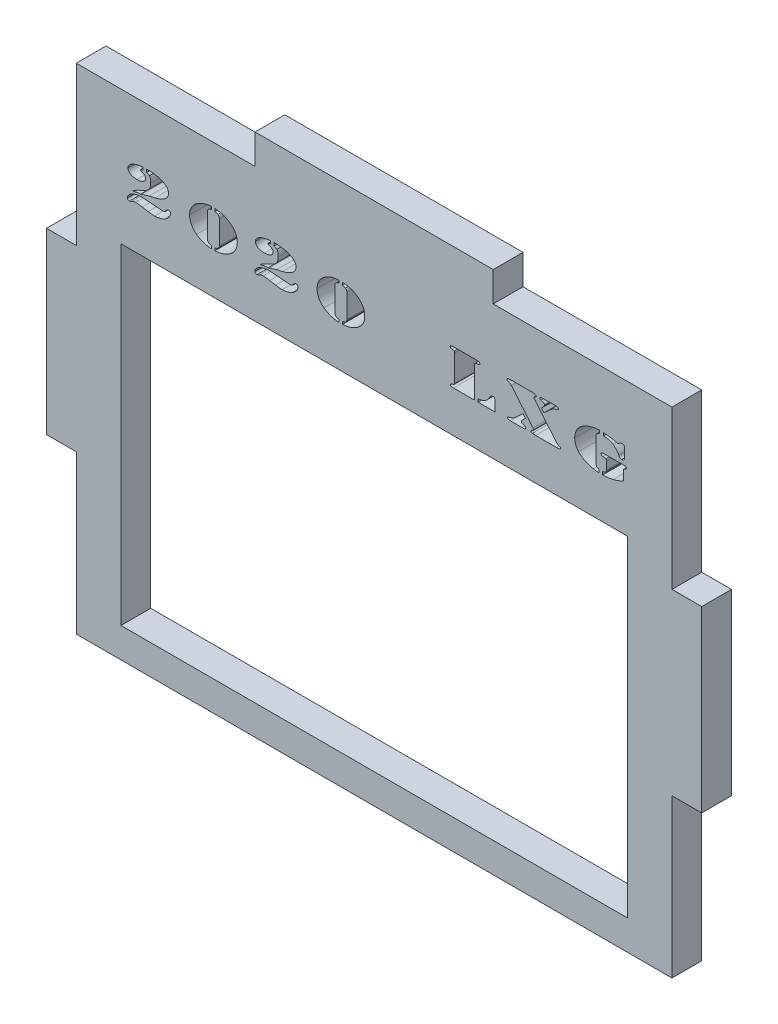
from build123d import *

# Parameters (mm, degrees)
SKETCH_1_W      = 85
SKETCH_1_H      = 55.5
EXTRUDE_1_DEPTH = 5


with BuildPart() as part:
    # 草图1 → 凸台-拉伸1 (new body)
    with BuildSketch(Plane.XY):
        Polygon((0, 56.5), (0, 83), (30, 83), (30, 88), (70, 88), (70, 83), (100, 83), (100, 56.5), (105, 56.5), (105, 26.5), (100, 26.5), (100, 0), (0, 0), (0, 26.5), (-5, 26.5), (-5, 56.5), align=None)
        with Locations((50, 32.75)):
            Rectangle(SKETCH_1_W, SKETCH_1_H, mode=Mode.SUBTRACT)
        with BuildLine():
            Line((11.243960394, 73.502712388), (11.243960394, 73.030056138))
            add(Edge.make_bspline(
                [(11.243960394, 73.030056138), (11.208356532, 73.024957352), (11.140050905, 73.015175386), (11.042783272, 72.999488883), (10.955969202, 72.978018571), (10.881173283, 72.955665786), (10.819813298, 72.932390889), (10.77780069, 72.907465304), (10.746828605, 72.883673166), (10.744808004, 72.862962635), (10.743960394, 72.854274888)],
                knots=[0, 0, 0, 0, 1.568141078, 3.008461882, 4.293495938, 5.46070142, 6.419961894, 7.124160036, 7.632598721, 8, 8, 8, 8], degree=3))
            add(Edge.make_bspline(
                [(10.743960394, 72.854274888), (10.750336564, 72.843370195), (10.765999629, 72.816582809), (10.813242839, 72.783900148), (10.88126676, 72.751467086), (10.935131949, 72.731402959), (10.96531456, 72.720160305)],
                knots=[0, 0, 0, 0, 0.568114765, 1.395574308, 2.540646225, 4, 4, 4, 4], degree=3))
            add(Edge.make_bspline(
                [(10.96531456, 72.720160305), (11.022900432, 72.697005052), (11.130912121, 72.6535736), (11.278777988, 72.581701385), (11.39887179, 72.503530293), (11.496045618, 72.423333018), (11.570388007, 72.336492082), (11.623787107, 72.241742613), (11.654707201, 72.136970947), (11.658622028, 72.064545604), (11.66062706, 72.027451971)],
                knots=[0, 0, 0, 0, 1.418245715, 2.66015099, 3.74948511, 4.685391483, 5.529861911, 6.346742097, 7.153261284, 8, 8, 8, 8], degree=3))
            add(Edge.make_bspline(
                [(11.66062706, 72.027451971), (11.65947005, 71.999549668), (11.657158981, 71.943816244), (11.635313174, 71.861740331), (11.599031057, 71.783606956), (11.552409888, 71.706319616), (11.488090951, 71.635302333), (11.412104692, 71.565558614), (11.321580477, 71.49977992), (11.183789323, 71.414336474), (10.990968728, 71.323949971), (10.739103557, 71.248225714), (10.468044161, 71.199574215), (10.280635971, 71.194255305), (10.18406456, 71.191514471)],
                knots=[0, 0, 0, 0, 0.542678628, 1.083972786, 1.64017819, 2.217255993, 2.834368391, 3.498554135, 4.223890276, 5.009756353, 6.654735481, 8.35272995, 10.120562317, 12, 12, 12, 12], degree=3))
            add(Edge.make_bspline(
                [(10.18406456, 71.191514471), (10.131078459, 71.192088187), (10.026675348, 71.193218629), (9.873804075, 71.20735047), (9.727063623, 71.225885349), (9.587301473, 71.254504042), (9.454963528, 71.292654102), (9.328374302, 71.336738691), (9.209080592, 71.389954459), (9.097278277, 71.451075301), (8.995321627, 71.517538745), (8.906035917, 71.589223778), (8.830402722, 71.665382537), (8.769444355, 71.746375403), (8.719765673, 71.830158051), (8.685876239, 71.919117268), (8.664017883, 72.011631949), (8.661759349, 72.075073434), (8.66062706, 72.106879055)],
                knots=[0, 0, 0, 0, 1.29980809, 2.561124635, 3.764681416, 4.928172237, 6.057624476, 7.14234884, 8.215137481, 9.258984428, 10.26632961, 11.197845937, 12.063984554, 12.892639025, 13.68001693, 14.445478345, 15.220659359, 16, 16, 16, 16], degree=3))
            add(Edge.make_bspline(
                [(8.66062706, 72.106879055), (8.661381531, 72.137372986), (8.662893612, 72.198487747), (8.68301976, 72.288650437), (8.710511404, 72.378161252), (8.754217735, 72.464383509), (8.805624468, 72.550600297), (8.870058893, 72.63470344), (8.94825786, 72.714705845), (9.034827004, 72.795636764), (9.131962639, 72.873014504), (9.238272664, 72.946247057), (9.353101367, 73.015349493), (9.476576031, 73.079586364), (9.607195258, 73.141786414), (9.74716246, 73.197171729), (9.89527236, 73.249361632), (9.997730863, 73.280043688), (10.049949977, 73.295681138)],
                knots=[0, 0, 0, 0, 0.749487658, 1.502094233, 2.266077757, 3.050138457, 3.875104159, 4.736722593, 5.651598863, 6.627395326, 7.654091009, 8.706724652, 9.804836348, 10.952405897, 12.133538331, 13.3662222, 14.657665893, 16, 16, 16, 16], degree=3))
            add(Edge.make_bspline(
                [(10.049949977, 73.295681138), (10.085930958, 73.305396154), (10.161550134, 73.325813649), (10.281299301, 73.354437353), (10.412903014, 73.381573749), (10.556177652, 73.407596952), (10.711714703, 73.431933795), (10.878737076, 73.456879007), (11.057676335, 73.479967754), (11.180583572, 73.494974299), (11.243960394, 73.502712388)],
                knots=[0, 0, 0, 0, 0.737360969, 1.549669503, 2.435538811, 3.395631217, 4.43046654, 5.550182927, 6.73675771, 8, 8, 8, 8], degree=3))
        make_face(mode=Mode.SUBTRACT)
        with BuildLine():
            Line((11.827293727, 73.030056138), (11.827293727, 73.515733221))
            Line((11.827293727, 73.515733221), (12.029116644, 73.524847805))
            add(Edge.make_bspline(
                [(12.029116644, 73.524847805), (12.157642504, 73.523227251), (12.411982653, 73.520020334), (12.78927799, 73.490483902), (13.157368065, 73.442497431), (13.51344751, 73.376802661), (13.85053477, 73.294617641), (14.162129387, 73.198062149), (14.444584301, 73.085859992), (14.616634368, 72.994656494), (14.69968956, 72.950629055)],
                knots=[0, 0, 0, 0, 1.118015334, 2.21244337, 3.290152378, 4.346264928, 5.361003953, 6.306865705, 7.182658889, 8, 8, 8, 8], degree=3))
            add(Edge.make_bspline(
                [(14.69968956, 72.950629055), (14.762605098, 72.912838144), (14.883913447, 72.839972948), (15.045758997, 72.713998062), (15.184894555, 72.582280122), (15.297871161, 72.441324575), (15.384679099, 72.292208521), (15.449154026, 72.136755361), (15.485880142, 71.972287904), (15.49125114, 71.860089216), (15.493960394, 71.803493638)],
                knots=[0, 0, 0, 0, 1.200175082, 2.314074766, 3.348938661, 4.329580918, 5.259113133, 6.163973684, 7.073866452, 8, 8, 8, 8], degree=3))
            add(Edge.make_bspline(
                [(15.493960394, 71.803493638), (15.492374905, 71.754291968), (15.489218467, 71.656339797), (15.458671193, 71.512658932), (15.413439184, 71.372671557), (15.347232322, 71.237590246), (15.261647843, 71.107071602), (15.157917037, 70.980407156), (15.036391092, 70.85778694), (14.896323606, 70.740994438), (14.740074149, 70.629154048), (14.566967525, 70.523700679), (14.378926555, 70.423632541), (14.174387078, 70.331671018), (13.955672495, 70.244064287), (13.720251729, 70.163971135), (13.470005781, 70.087840208), (13.296267736, 70.045286912), (13.20750206, 70.023545721)],
                knots=[0, 0, 0, 0, 0.758154045, 1.509355944, 2.256877586, 3.023589311, 3.822270508, 4.660001328, 5.545484151, 6.48177245, 7.47040686, 8.507498621, 9.606906727, 10.754666619, 11.965843324, 13.240711804, 14.59023346, 16, 16, 16, 16], degree=3))
            Line((13.20750206, 70.023545721), (12.225731227, 69.794379055))
            add(Edge.make_bspline(
                [(12.225731227, 69.794379055), (12.188372159, 69.785395827), (12.109557343, 69.766444297), (11.986271973, 69.73387579), (11.852350775, 69.695825338), (11.707479479, 69.653838349), (11.550758724, 69.608952728), (11.3836831, 69.556199982), (11.205220872, 69.500462476), (11.082917907, 69.461538159), (11.02000206, 69.441514471)],
                knots=[0, 0, 0, 0, 0.73385779, 1.54818818, 2.435221081, 3.392847843, 4.429055981, 5.548651901, 6.738962369, 8, 8, 8, 8], degree=3))
            Line((11.02000206, 69.441514471), (10.794741644, 69.365993638))
            add(Edge.make_bspline(
                [(10.794741644, 69.365993638), (10.696546078, 69.363837248), (10.503413613, 69.359596029), (10.259720301, 69.328423697), (10.053653726, 69.288505563), (9.868605625, 69.251941075), (9.65362374, 69.19910067), (9.49961465, 69.161937475), (9.417137477, 69.142035305)],
                knots=[0, 0, 0, 0, 1.262568588, 2.483238246, 3.153283748, 3.962312188, 4.908747981, 6, 6, 6, 6], degree=3))
            add(Edge.make_bspline(
                [(9.417137477, 69.142035305), (9.507299002, 69.208993339), (9.683370961, 69.339752355), (9.920816579, 69.484900274), (10.129044377, 69.59617339), (10.318715037, 69.690903103), (10.541829476, 69.799051711), (10.703417701, 69.872450146), (10.78953331, 69.911566555)],
                knots=[0, 0, 0, 0, 1.281031401, 2.501662525, 3.170865986, 3.974885781, 4.920750908, 6, 6, 6, 6], degree=3))
            add(Edge.make_bspline(
                [(10.78953331, 69.911566555), (10.846414367, 69.937557645), (10.955047876, 69.987196374), (11.110820093, 70.059338291), (11.252288823, 70.124892464), (11.378537178, 70.186686851), (11.490834963, 70.241151109), (11.588433744, 70.289963336), (11.670599117, 70.335199217), (11.762253306, 70.384137647), (11.862271798, 70.446749684), (11.970460595, 70.528571129), (12.071949651, 70.613695027), (12.132106515, 70.677038949), (12.161929144, 70.708441555)],
                knots=[0, 0, 0, 0, 1.408935073, 2.690835374, 3.867577003, 4.921557396, 5.857425364, 6.679565474, 7.379590845, 7.970353833, 9.020334976, 10.033376881, 11.025051034, 12, 12, 12, 12], degree=3))
            add(Edge.make_bspline(
                [(12.161929144, 70.708441555), (12.189673521, 70.74123417), (12.245292559, 70.806973388), (12.314083803, 70.917666303), (12.371453374, 71.036474092), (12.417661737, 71.16520643), (12.453081026, 71.306894547), (12.476901947, 71.46426209), (12.491014246, 71.63873878), (12.492947107, 71.760496456), (12.493960394, 71.824326971)],
                knots=[0, 0, 0, 0, 0.863650459, 1.731356466, 2.614407403, 3.515298691, 4.479376405, 5.549413022, 6.715298838, 8, 8, 8, 8], degree=3))
            add(Edge.make_bspline(
                [(12.493960394, 71.824326971), (12.49301983, 71.880759971), (12.491217031, 71.988926392), (12.48292697, 72.143722403), (12.466396852, 72.284330896), (12.441246027, 72.410222939), (12.412555061, 72.523250933), (12.374879633, 72.621040117), (12.330921317, 72.705243686), (12.29413229, 72.752307137), (12.276512477, 72.774847805)],
                knots=[0, 0, 0, 0, 1.363946589, 2.614307652, 3.744894914, 4.781672701, 5.71543866, 6.558882658, 7.309788247, 8, 8, 8, 8], degree=3))
            add(Edge.make_bspline(
                [(12.276512477, 72.774847805), (12.248642088, 72.804906797), (12.194881123, 72.862889499), (12.09162459, 72.927684755), (11.969774961, 72.983500573), (11.878489328, 73.013328039), (11.827293727, 73.030056138)],
                knots=[0, 0, 0, 0, 0.934699483, 1.80300131, 2.767860111, 4, 4, 4, 4], degree=3))
        make_face(mode=Mode.SUBTRACT)
        with BuildLine():
            add(Edge.make_bspline(
                [(15.44578331, 69.358181138), (15.471852953, 69.357495851), (15.522181246, 69.356172881), (15.595420535, 69.344137123), (15.660584481, 69.317183301), (15.71861161, 69.282118324), (15.76718658, 69.238658906), (15.802275186, 69.185813415), (15.824044341, 69.12630807), (15.82619953, 69.084058473), (15.827293727, 69.062608221)],
                knots=[0, 0, 0, 0, 1.156433597, 2.232532701, 3.269168633, 4.262915714, 5.230208503, 6.132490491, 7.051859588, 8, 8, 8, 8], degree=3))
            add(Edge.make_bspline(
                [(15.827293727, 69.062608221), (15.823701391, 69.01103484), (15.816146671, 68.902575473), (15.760847812, 68.737562072), (15.672990123, 68.565120916), (15.554669594, 68.388669542), (15.414006492, 68.215880783), (15.25653775, 68.056689914), (15.084922939, 67.915694624), (14.960951751, 67.836578301), (14.89890831, 67.796983221)],
                knots=[0, 0, 0, 0, 0.760681764, 1.599721807, 2.545371349, 3.61345798, 4.729297358, 5.830319954, 6.914147557, 8, 8, 8, 8], degree=3))
            add(Edge.make_bspline(
                [(14.89890831, 67.796983221), (14.841198926, 67.765280025), (14.721627172, 67.699592149), (14.526601391, 67.61518445), (14.311319814, 67.54245856), (14.082116237, 67.476633512), (13.845995668, 67.424064159), (13.612089405, 67.386281922), (13.384182289, 67.363177114), (13.234462177, 67.359831193), (13.16062706, 67.358181138)],
                knots=[0, 0, 0, 0, 0.872372735, 1.807524734, 2.811750183, 3.882450595, 4.966893951, 6.01572016, 7.021443876, 8, 8, 8, 8], degree=3))
            add(Edge.make_bspline(
                [(13.16062706, 67.358181138), (13.07204729, 67.359442347), (12.892077588, 67.362004777), (12.618918204, 67.383033518), (12.337719325, 67.413420723), (12.148787997, 67.44411118), (12.052554144, 67.459743638)],
                knots=[0, 0, 0, 0, 0.954092098, 1.938452412, 2.94993239, 4, 4, 4, 4], degree=3))
            Line((12.052554144, 67.459743638), (11.064272894, 67.632920721))
            add(Edge.make_bspline(
                [(11.064272894, 67.632920721), (10.997885353, 67.644312271), (10.871719707, 67.665961245), (10.691241389, 67.695227046), (10.528637083, 67.717684335), (10.384768858, 67.739262547), (10.258909443, 67.755348432), (10.151597121, 67.765347998), (10.062194643, 67.772645902), (10.008727143, 67.774167971), (9.98484581, 67.774847805)],
                knots=[0, 0, 0, 0, 1.483819019, 2.819911411, 4.027375817, 5.099626023, 6.024634116, 6.821882638, 7.473792244, 8, 8, 8, 8], degree=3))
            add(Edge.make_bspline(
                [(9.98484581, 67.774847805), (9.929099782, 67.772095923), (9.814673433, 67.766447309), (9.641063878, 67.72657671), (9.463373602, 67.660987271), (9.347930752, 67.60043324), (9.288231227, 67.569118638)],
                knots=[0, 0, 0, 0, 0.91117856, 1.870318614, 2.898667475, 4, 4, 4, 4], degree=3))
            add(Edge.make_bspline(
                [(9.288231227, 67.569118638), (9.252083513, 67.549768404), (9.18605732, 67.51442392), (9.090529011, 67.475088114), (9.009806445, 67.447436666), (8.958957215, 67.443319241), (8.936668727, 67.441514471)],
                knots=[0, 0, 0, 0, 1.30375872, 2.381401607, 3.290527888, 4, 4, 4, 4], degree=3))
            add(Edge.make_bspline(
                [(8.936668727, 67.441514471), (8.909702196, 67.44206573), (8.858449966, 67.443113444), (8.78650324, 67.456162721), (8.724187115, 67.47708558), (8.670544532, 67.504860083), (8.629782029, 67.544087264), (8.597945437, 67.589020595), (8.581409555, 67.643153761), (8.578698956, 67.681005805), (8.577293727, 67.700629055)],
                knots=[0, 0, 0, 0, 1.292810969, 2.457099273, 3.491155099, 4.441944608, 5.326068073, 6.181007757, 7.056998346, 8, 8, 8, 8], degree=3))
            add(Edge.make_bspline(
                [(8.577293727, 67.700629055), (8.579648987, 67.741233059), (8.584469572, 67.824338562), (8.622031313, 67.948084855), (8.681915593, 68.071903138), (8.764684299, 68.194326426), (8.865439331, 68.315316028), (8.986347748, 68.427829339), (9.122181857, 68.534654924), (9.222449981, 68.596151763), (9.27390831, 68.627712388)],
                knots=[0, 0, 0, 0, 0.805260994, 1.64815318, 2.546335388, 3.528763931, 4.574868588, 5.66615045, 6.802251448, 8, 8, 8, 8], degree=3))
            add(Edge.make_bspline(
                [(9.27390831, 68.627712388), (9.332869377, 68.659554334), (9.453144124, 68.724508756), (9.64780296, 68.804735844), (9.857109869, 68.873500708), (10.082132191, 68.929463397), (10.322386582, 68.971677258), (10.577905342, 69.003009606), (10.849170765, 69.020974854), (11.035166746, 69.023533759), (11.130679144, 69.024847805)],
                knots=[0, 0, 0, 0, 0.837199238, 1.707803677, 2.627441744, 3.589368586, 4.603610722, 5.674974312, 6.806056043, 8, 8, 8, 8], degree=3))
            add(Edge.make_bspline(
                [(11.130679144, 69.024847805), (11.178427365, 69.024684167), (11.277423707, 69.024344899), (11.431936288, 69.018369064), (11.598605003, 69.010557234), (11.777500363, 69.000579701), (11.967970108, 68.985551272), (12.170311837, 68.969070699), (12.384652722, 68.947809495), (12.531728041, 68.93246552), (12.607241644, 68.924587388)],
                knots=[0, 0, 0, 0, 0.773927047, 1.604582233, 2.506103488, 3.478620059, 4.50870111, 5.603018327, 6.769305932, 8, 8, 8, 8], degree=3))
            add(Edge.make_bspline(
                [(12.607241644, 68.924587388), (12.715294687, 68.912678692), (12.921352056, 68.889968785), (13.21615074, 68.860474363), (13.481243825, 68.833784287), (13.717009654, 68.813435961), (13.923093696, 68.795832934), (14.099763568, 68.783968183), (14.246947462, 68.777142829), (14.335101543, 68.775552562), (14.374168727, 68.774847805)],
                knots=[0, 0, 0, 0, 1.470831308, 2.804878255, 4.008617927, 5.075690671, 6.006685754, 6.807096688, 7.471341842, 8, 8, 8, 8], degree=3))
            add(Edge.make_bspline(
                [(14.374168727, 68.774847805), (14.430257637, 68.775820567), (14.535011236, 68.777637332), (14.680041047, 68.797698659), (14.803811899, 68.825770792), (14.873329353, 68.860417381), (14.905418727, 68.876410305)],
                knots=[0, 0, 0, 0, 1.230960879, 2.298985351, 3.21480878, 4, 4, 4, 4], degree=3))
            add(Edge.make_bspline(
                [(14.905418727, 68.876410305), (14.924338187, 68.889480624), (14.959775051, 68.913961827), (14.995616589, 68.956069013), (15.019081564, 68.996168981), (15.040423594, 69.035279017), (15.061470113, 69.085275864), (15.077643807, 69.121242791), (15.08640831, 69.140733221)],
                knots=[0, 0, 0, 0, 1.263704728, 2.366966811, 3.011385651, 3.825111557, 4.821430774, 6, 6, 6, 6], degree=3))
            add(Edge.make_bspline(
                [(15.08640831, 69.140733221), (15.102202857, 69.172556458), (15.133455974, 69.235525997), (15.216965249, 69.305747119), (15.324041441, 69.348497589), (15.403237977, 69.354797012), (15.44578331, 69.358181138)],
                knots=[0, 0, 0, 0, 0.946880653, 1.873619569, 2.857682805, 4, 4, 4, 4], degree=3))
        make_face(mode=Mode.SUBTRACT)
        with BuildLine():
            add(Edge.make_bspline(
                [(22.693960394, 67.368597805), (22.567932628, 67.379750425), (22.321971144, 67.401516384), (21.964752591, 67.457343064), (21.629621895, 67.53306173), (21.313721875, 67.625475054), (21.014157223, 67.739109756), (20.728211815, 67.877636656), (20.450557666, 68.03488999), (20.277123711, 68.159103239), (20.190054144, 68.221462388)],
                knots=[0, 0, 0, 0, 1.131477545, 2.208242736, 3.231082639, 4.202747721, 5.150160148, 6.093051664, 7.042649021, 8, 8, 8, 8], degree=3))
            add(Edge.make_bspline(
                [(20.190054144, 68.221462388), (20.143718598, 68.257073722), (20.051988892, 68.327572885), (19.921456739, 68.439518151), (19.800452191, 68.556767544), (19.688229926, 68.6783527), (19.583524954, 68.803639484), (19.4868919, 68.933715562), (19.399874867, 69.069224517), (19.321468981, 69.208736376), (19.252665073, 69.35195603), (19.192323878, 69.498352919), (19.141477249, 69.6484079), (19.100134888, 69.801566954), (19.067281203, 69.957590433), (19.04350132, 70.116671874), (19.030974266, 70.279420644), (19.028525951, 70.388978661), (19.027293727, 70.444118638)],
                knots=[0, 0, 0, 0, 1.075623412, 2.129393674, 3.163382107, 4.175406778, 5.173810379, 6.167728479, 7.156140244, 8.136250785, 9.111791717, 10.079151936, 11.049345421, 12.026161464, 12.99766993, 13.982944539, 14.984826521, 16, 16, 16, 16], degree=3))
            add(Edge.make_bspline(
                [(19.027293727, 70.444118638), (19.02852177, 70.498825143), (19.030961675, 70.607517388), (19.043582106, 70.769390007), (19.067309162, 70.928033748), (19.0999224, 71.083690738), (19.141723874, 71.236289534), (19.192293925, 71.385986254), (19.252673163, 71.532372795), (19.321466795, 71.675595244), (19.399875459, 71.815106348), (19.48689174, 71.950615508), (19.583524997, 72.08069153), (19.688229914, 72.205978329), (19.800452194, 72.327563481), (19.921456738, 72.444812876), (20.051988893, 72.556758141), (20.143718598, 72.627257304), (20.190054144, 72.662868638)],
                knots=[0, 0, 0, 0, 1.008679411, 2.00406933, 2.990802959, 3.963750061, 4.934292421, 5.905922593, 6.874715305, 7.851700844, 8.833262758, 9.823138188, 10.818528108, 11.818410172, 12.831933475, 13.867453064, 14.922783777, 16, 16, 16, 16], degree=3))
            add(Edge.make_bspline(
                [(20.190054144, 72.662868638), (20.277123711, 72.725227787), (20.450557666, 72.849441036), (20.728211815, 73.00669437), (21.014157223, 73.14522127), (21.313721875, 73.258855972), (21.629621895, 73.351269296), (21.964752591, 73.426987963), (22.321971144, 73.482814642), (22.567932628, 73.504580601), (22.693960394, 73.515733221)],
                knots=[0, 0, 0, 0, 0.957350979, 1.906948336, 2.849839852, 3.797252279, 4.768917361, 5.791757264, 6.868522455, 8, 8, 8, 8], degree=3))
            Line((22.693960394, 73.515733221), (22.693960394, 73.053493638))
            add(Edge.make_bspline(
                [(22.693960394, 73.053493638), (22.661805071, 73.04715246), (22.602165438, 73.03539125), (22.521153435, 73.016923751), (22.455105033, 73.002219304), (22.389440879, 72.981699003), (22.318711447, 72.94971559), (22.269824482, 72.915036649), (22.244741644, 72.897243638)],
                knots=[0, 0, 0, 0, 1.227206041, 2.27614319, 3.111886077, 3.759576109, 4.850487211, 6, 6, 6, 6], degree=3))
            add(Edge.make_bspline(
                [(22.244741644, 72.897243638), (22.21129192, 72.867979891), (22.145391198, 72.810326139), (22.076537749, 72.695325408), (22.033041367, 72.56354257), (22.029264018, 72.468798314), (22.027293727, 72.419379055)],
                knots=[0, 0, 0, 0, 0.974222151, 1.919356464, 2.914721943, 4, 4, 4, 4], degree=3))
            Line((22.027293727, 72.419379055), (22.027293727, 68.442816555))
            add(Edge.make_bspline(
                [(22.027293727, 68.442816555), (22.029174936, 68.394224757), (22.032764226, 68.301513045), (22.07723218, 68.172713229), (22.145083091, 68.059658054), (22.211243654, 68.003700637), (22.244741644, 67.975368638)],
                knots=[0, 0, 0, 0, 1.084573961, 2.06933503, 3.022478145, 4, 4, 4, 4], degree=3))
            add(Edge.make_bspline(
                [(22.244741644, 67.975368638), (22.26984923, 67.958058365), (22.318822939, 67.924293738), (22.389307067, 67.892794586), (22.455562128, 67.875104896), (22.520689808, 67.857227126), (22.602431013, 67.841879696), (22.661866904, 67.829636061), (22.693960394, 67.823024888)],
                knots=[0, 0, 0, 0, 1.144394473, 2.232203454, 2.877307558, 3.719762964, 4.768744581, 6, 6, 6, 6], degree=3))
            Line((22.693960394, 67.823024888), (22.693960394, 67.368597805))
        make_face(mode=Mode.SUBTRACT)
        with BuildLine():
            Line((23.277293727, 67.368597805), (23.277293727, 67.823024888))
            add(Edge.make_bspline(
                [(23.277293727, 67.823024888), (23.313739329, 67.829589009), (23.380594535, 67.841630124), (23.472180204, 67.857352469), (23.544817336, 67.874905512), (23.618933736, 67.893222527), (23.698488991, 67.923286675), (23.754358377, 67.957921611), (23.78250206, 67.975368638)],
                knots=[0, 0, 0, 0, 1.25294387, 2.298379375, 3.142533666, 3.780050676, 4.881721187, 6, 6, 6, 6], degree=3))
            add(Edge.make_bspline(
                [(23.78250206, 67.975368638), (23.81984938, 68.003510622), (23.892684846, 68.058393663), (23.971280277, 68.170789198), (24.019356349, 68.301084227), (24.024570988, 68.394198478), (24.027293727, 68.442816555)],
                knots=[0, 0, 0, 0, 1.013819062, 1.977169571, 2.943812327, 4, 4, 4, 4], degree=3))
            Line((24.027293727, 68.442816555), (24.027293727, 72.419379055))
            add(Edge.make_bspline(
                [(24.027293727, 72.419379055), (24.024478026, 72.468818976), (24.019060476, 72.563943852), (23.972051571, 72.697286265), (23.892392189, 72.811558312), (23.819798802, 72.868162013), (23.78250206, 72.897243638)],
                knots=[0, 0, 0, 0, 1.057671965, 2.035013625, 2.990437099, 4, 4, 4, 4], degree=3))
            add(Edge.make_bspline(
                [(23.78250206, 72.897243638), (23.754384667, 72.915177727), (23.698615422, 72.950748969), (23.618796937, 72.981239817), (23.545236024, 73.002442804), (23.471759218, 73.016776731), (23.380839422, 73.035669858), (23.313797147, 73.047210142), (23.277293727, 73.053493638)],
                knots=[0, 0, 0, 0, 1.12264122, 2.226694858, 2.866359468, 3.705046757, 4.75043557, 6, 6, 6, 6], degree=3))
            Line((23.277293727, 73.053493638), (23.277293727, 73.515733221))
            add(Edge.make_bspline(
                [(23.277293727, 73.515733221), (23.40635502, 73.504583483), (23.657934021, 73.482849313), (24.022986815, 73.42715034), (24.365363581, 73.350975523), (24.688374309, 73.259184739), (24.994995154, 73.144841746), (25.288038871, 73.007493637), (25.571542499, 72.849092332), (25.749193471, 72.725163033), (25.838491644, 72.662868638)],
                knots=[0, 0, 0, 0, 1.135789637, 2.213993179, 3.235335468, 4.209854837, 5.156481814, 6.101515915, 7.045706544, 8, 8, 8, 8], degree=3))
            add(Edge.make_bspline(
                [(25.838491644, 72.662868638), (25.886170758, 72.627319269), (25.980280659, 72.557151279), (26.113513736, 72.444790154), (26.237184109, 72.327610191), (26.351922175, 72.205951381), (26.459380914, 72.081123552), (26.557170355, 71.950580303), (26.645695268, 71.815197033), (26.724995017, 71.675263649), (26.796980628, 71.532764611), (26.858299145, 71.385979257), (26.910186238, 71.236316543), (26.95365011, 71.083890962), (26.98600367, 70.928019719), (27.009274183, 70.769321391), (27.024064161, 70.607590082), (27.026212699, 70.49883722), (27.027293727, 70.444118638)],
                knots=[0, 0, 0, 0, 1.089907573, 2.15127935, 3.192332311, 4.210892631, 5.21528104, 6.209695766, 7.198206027, 8.178035106, 9.156409833, 10.122678072, 11.091301313, 12.058387911, 13.025736237, 14.006791758, 14.997124984, 16, 16, 16, 16], degree=3))
            add(Edge.make_bspline(
                [(27.027293727, 70.444118638), (27.026208677, 70.388966665), (27.024052067, 70.279348481), (27.009358734, 70.116739669), (26.986031298, 69.957604073), (26.953434873, 69.801369497), (26.910438863, 69.648377027), (26.858268327, 69.498360414), (26.796988991, 69.351564069), (26.724992761, 69.20906801), (26.645695878, 69.069133821), (26.55717019, 68.933750769), (26.459380959, 68.803207461), (26.351922163, 68.678379649), (26.237184112, 68.556720834), (26.113513735, 68.439540872), (25.980280659, 68.327179747), (25.886170758, 68.257011757), (25.838491644, 68.221462388)],
                knots=[0, 0, 0, 0, 1.009341695, 2.006133165, 2.985747747, 3.951675268, 4.924989181, 5.892189743, 6.857038764, 7.83397649, 8.812366432, 9.799424806, 10.792378972, 11.795292173, 12.812356469, 13.85188037, 14.911693243, 16, 16, 16, 16], degree=3))
            add(Edge.make_bspline(
                [(25.838491644, 68.221462388), (25.749193471, 68.159167993), (25.571542499, 68.035238695), (25.288038871, 67.876837389), (24.994995154, 67.73948928), (24.688374309, 67.625146287), (24.365363581, 67.533355503), (24.022986815, 67.457180686), (23.657934021, 67.401481713), (23.40635502, 67.379747543), (23.277293727, 67.368597805)],
                knots=[0, 0, 0, 0, 0.954293456, 1.898484085, 2.843518186, 3.790145163, 4.764664532, 5.786006821, 6.864210363, 8, 8, 8, 8], degree=3))
        make_face(mode=Mode.SUBTRACT)
        with BuildLine():
            Line((32.643960394, 73.502712388), (32.643960394, 73.030056138))
            add(Edge.make_bspline(
                [(32.643960394, 73.030056138), (32.608356532, 73.024957352), (32.540050905, 73.015175386), (32.442783272, 72.999488883), (32.355969202, 72.978018571), (32.281173283, 72.955665786), (32.219813298, 72.932390889), (32.17780069, 72.907465304), (32.146828605, 72.883673166), (32.144808004, 72.862962635), (32.143960394, 72.854274888)],
                knots=[0, 0, 0, 0, 1.568141078, 3.008461882, 4.293495938, 5.46070142, 6.419961894, 7.124160036, 7.632598721, 8, 8, 8, 8], degree=3))
            add(Edge.make_bspline(
                [(32.143960394, 72.854274888), (32.150336564, 72.843370195), (32.165999629, 72.816582809), (32.213242839, 72.783900148), (32.28126676, 72.751467086), (32.335131949, 72.731402959), (32.36531456, 72.720160305)],
                knots=[0, 0, 0, 0, 0.568114765, 1.395574308, 2.540646225, 4, 4, 4, 4], degree=3))
            add(Edge.make_bspline(
                [(32.36531456, 72.720160305), (32.422900432, 72.697005052), (32.530912121, 72.6535736), (32.678777988, 72.581701385), (32.79887179, 72.503530293), (32.896045618, 72.423333018), (32.970388007, 72.336492082), (33.023787107, 72.241742613), (33.054707201, 72.136970947), (33.058622028, 72.064545604), (33.06062706, 72.027451971)],
                knots=[0, 0, 0, 0, 1.418245715, 2.66015099, 3.74948511, 4.685391483, 5.529861911, 6.346742097, 7.153261284, 8, 8, 8, 8], degree=3))
            add(Edge.make_bspline(
                [(33.06062706, 72.027451971), (33.05947005, 71.999549668), (33.057158981, 71.943816244), (33.035313174, 71.861740331), (32.999031057, 71.783606956), (32.952409888, 71.706319616), (32.888090951, 71.635302333), (32.812104692, 71.565558614), (32.721580477, 71.49977992), (32.583789323, 71.414336474), (32.390968728, 71.323949971), (32.139103557, 71.248225714), (31.868044161, 71.199574215), (31.680635971, 71.194255305), (31.58406456, 71.191514471)],
                knots=[0, 0, 0, 0, 0.542678628, 1.083972786, 1.64017819, 2.217255993, 2.834368391, 3.498554135, 4.223890276, 5.009756353, 6.654735481, 8.35272995, 10.120562317, 12, 12, 12, 12], degree=3))
            add(Edge.make_bspline(
                [(31.58406456, 71.191514471), (31.531078459, 71.192088187), (31.426675348, 71.193218629), (31.273804075, 71.20735047), (31.127063623, 71.225885349), (30.987301473, 71.254504042), (30.854963528, 71.292654102), (30.728374302, 71.336738691), (30.609080592, 71.389954459), (30.497278277, 71.451075301), (30.395321627, 71.517538745), (30.306035917, 71.589223778), (30.230402722, 71.665382537), (30.169444355, 71.746375403), (30.119765673, 71.830158051), (30.085876239, 71.919117268), (30.064017883, 72.011631949), (30.061759349, 72.075073434), (30.06062706, 72.106879055)],
                knots=[0, 0, 0, 0, 1.29980809, 2.561124635, 3.764681416, 4.928172237, 6.057624476, 7.14234884, 8.215137481, 9.258984428, 10.26632961, 11.197845937, 12.063984554, 12.892639025, 13.68001693, 14.445478345, 15.220659359, 16, 16, 16, 16], degree=3))
            add(Edge.make_bspline(
                [(30.06062706, 72.106879055), (30.061381531, 72.137372986), (30.062893612, 72.198487747), (30.08301976, 72.288650437), (30.110511404, 72.378161252), (30.154217735, 72.464383509), (30.205624468, 72.550600297), (30.270058893, 72.63470344), (30.34825786, 72.714705845), (30.434827004, 72.795636764), (30.531962639, 72.873014504), (30.638272664, 72.946247057), (30.753101367, 73.015349493), (30.876576031, 73.079586364), (31.007195258, 73.141786414), (31.14716246, 73.197171729), (31.29527236, 73.249361632), (31.397730863, 73.280043688), (31.449949977, 73.295681138)],
                knots=[0, 0, 0, 0, 0.749487658, 1.502094233, 2.266077757, 3.050138457, 3.875104159, 4.736722593, 5.651598863, 6.627395326, 7.654091009, 8.706724652, 9.804836348, 10.952405897, 12.133538331, 13.3662222, 14.657665893, 16, 16, 16, 16], degree=3))
            add(Edge.make_bspline(
                [(31.449949977, 73.295681138), (31.485930958, 73.305396154), (31.561550134, 73.325813649), (31.681299301, 73.354437353), (31.812903014, 73.381573749), (31.956177652, 73.407596952), (32.111714703, 73.431933795), (32.278737076, 73.456879007), (32.457676335, 73.479967754), (32.580583572, 73.494974299), (32.643960394, 73.502712388)],
                knots=[0, 0, 0, 0, 0.737360969, 1.549669503, 2.435538811, 3.395631217, 4.43046654, 5.550182927, 6.73675771, 8, 8, 8, 8], degree=3))
        make_face(mode=Mode.SUBTRACT)
        with BuildLine():
            Line((33.227293727, 73.030056138), (33.227293727, 73.515733221))
            Line((33.227293727, 73.515733221), (33.429116644, 73.524847805))
            add(Edge.make_bspline(
                [(33.429116644, 73.524847805), (33.557642504, 73.523227251), (33.811982653, 73.520020334), (34.18927799, 73.490483902), (34.557368065, 73.442497431), (34.91344751, 73.376802661), (35.25053477, 73.294617641), (35.562129387, 73.198062149), (35.844584301, 73.085859992), (36.016634368, 72.994656494), (36.09968956, 72.950629055)],
                knots=[0, 0, 0, 0, 1.118015334, 2.21244337, 3.290152378, 4.346264928, 5.361003953, 6.306865705, 7.182658889, 8, 8, 8, 8], degree=3))
            add(Edge.make_bspline(
                [(36.09968956, 72.950629055), (36.162605098, 72.912838144), (36.283913447, 72.839972948), (36.445758997, 72.713998062), (36.584894555, 72.582280122), (36.697871161, 72.441324575), (36.784679099, 72.292208521), (36.849154026, 72.136755361), (36.885880142, 71.972287904), (36.89125114, 71.860089216), (36.893960394, 71.803493638)],
                knots=[0, 0, 0, 0, 1.200175082, 2.314074766, 3.348938661, 4.329580918, 5.259113133, 6.163973684, 7.073866452, 8, 8, 8, 8], degree=3))
            add(Edge.make_bspline(
                [(36.893960394, 71.803493638), (36.892374905, 71.754291968), (36.889218467, 71.656339797), (36.858671193, 71.512658932), (36.813439184, 71.372671557), (36.747232322, 71.237590246), (36.661647843, 71.107071602), (36.557917037, 70.980407156), (36.436391092, 70.85778694), (36.296323606, 70.740994438), (36.140074149, 70.629154048), (35.966967525, 70.523700679), (35.778926555, 70.423632541), (35.574387078, 70.331671018), (35.355672495, 70.244064287), (35.120251729, 70.163971135), (34.870005781, 70.087840208), (34.696267736, 70.045286912), (34.60750206, 70.023545721)],
                knots=[0, 0, 0, 0, 0.758154045, 1.509355944, 2.256877586, 3.023589311, 3.822270508, 4.660001328, 5.545484151, 6.48177245, 7.47040686, 8.507498621, 9.606906727, 10.754666619, 11.965843324, 13.240711804, 14.59023346, 16, 16, 16, 16], degree=3))
            Line((34.60750206, 70.023545721), (33.625731227, 69.794379055))
            add(Edge.make_bspline(
                [(33.625731227, 69.794379055), (33.588372159, 69.785395827), (33.509557343, 69.766444297), (33.386271973, 69.73387579), (33.252350775, 69.695825338), (33.107479479, 69.653838349), (32.950758724, 69.608952728), (32.7836831, 69.556199982), (32.605220872, 69.500462476), (32.482917907, 69.461538159), (32.42000206, 69.441514471)],
                knots=[0, 0, 0, 0, 0.73385779, 1.54818818, 2.435221081, 3.392847843, 4.429055981, 5.548651901, 6.738962369, 8, 8, 8, 8], degree=3))
            Line((32.42000206, 69.441514471), (32.194741644, 69.365993638))
            add(Edge.make_bspline(
                [(32.194741644, 69.365993638), (32.096546078, 69.363837248), (31.903413613, 69.359596029), (31.659720301, 69.328423697), (31.453653726, 69.288505563), (31.268605625, 69.251941075), (31.05362374, 69.19910067), (30.89961465, 69.161937475), (30.817137477, 69.142035305)],
                knots=[0, 0, 0, 0, 1.262568588, 2.483238246, 3.153283748, 3.962312188, 4.908747981, 6, 6, 6, 6], degree=3))
            add(Edge.make_bspline(
                [(30.817137477, 69.142035305), (30.907299002, 69.208993339), (31.083370961, 69.339752355), (31.320816579, 69.484900274), (31.529044377, 69.59617339), (31.718715037, 69.690903103), (31.941829476, 69.799051711), (32.103417701, 69.872450146), (32.18953331, 69.911566555)],
                knots=[0, 0, 0, 0, 1.281031401, 2.501662525, 3.170865986, 3.974885781, 4.920750908, 6, 6, 6, 6], degree=3))
            add(Edge.make_bspline(
                [(32.18953331, 69.911566555), (32.246414367, 69.937557645), (32.355047876, 69.987196374), (32.510820093, 70.059338291), (32.652288823, 70.124892464), (32.778537178, 70.186686851), (32.890834963, 70.241151109), (32.988433744, 70.289963336), (33.070599117, 70.335199217), (33.162253306, 70.384137647), (33.262271798, 70.446749684), (33.370460595, 70.528571129), (33.471949651, 70.613695027), (33.532106515, 70.677038949), (33.561929144, 70.708441555)],
                knots=[0, 0, 0, 0, 1.408935073, 2.690835374, 3.867577003, 4.921557396, 5.857425364, 6.679565474, 7.379590845, 7.970353833, 9.020334976, 10.033376881, 11.025051034, 12, 12, 12, 12], degree=3))
            add(Edge.make_bspline(
                [(33.561929144, 70.708441555), (33.589673521, 70.74123417), (33.645292559, 70.806973388), (33.714083803, 70.917666303), (33.771453374, 71.036474092), (33.817661737, 71.16520643), (33.853081026, 71.306894547), (33.876901947, 71.46426209), (33.891014246, 71.63873878), (33.892947107, 71.760496456), (33.893960394, 71.824326971)],
                knots=[0, 0, 0, 0, 0.863650459, 1.731356466, 2.614407403, 3.515298691, 4.479376405, 5.549413022, 6.715298838, 8, 8, 8, 8], degree=3))
            add(Edge.make_bspline(
                [(33.893960394, 71.824326971), (33.89301983, 71.880759971), (33.891217031, 71.988926392), (33.88292697, 72.143722403), (33.866396852, 72.284330896), (33.841246027, 72.410222939), (33.812555061, 72.523250933), (33.774879633, 72.621040117), (33.730921317, 72.705243686), (33.69413229, 72.752307137), (33.676512477, 72.774847805)],
                knots=[0, 0, 0, 0, 1.363946589, 2.614307652, 3.744894914, 4.781672701, 5.71543866, 6.558882658, 7.309788247, 8, 8, 8, 8], degree=3))
            add(Edge.make_bspline(
                [(33.676512477, 72.774847805), (33.648642088, 72.804906797), (33.594881123, 72.862889499), (33.49162459, 72.927684755), (33.369774961, 72.983500573), (33.278489328, 73.013328039), (33.227293727, 73.030056138)],
                knots=[0, 0, 0, 0, 0.934699483, 1.80300131, 2.767860111, 4, 4, 4, 4], degree=3))
        make_face(mode=Mode.SUBTRACT)
        with BuildLine():
            add(Edge.make_bspline(
                [(36.84578331, 69.358181138), (36.871852953, 69.357495851), (36.922181246, 69.356172881), (36.995420535, 69.344137123), (37.060584481, 69.317183301), (37.11861161, 69.282118324), (37.16718658, 69.238658906), (37.202275186, 69.185813415), (37.224044341, 69.12630807), (37.22619953, 69.084058473), (37.227293727, 69.062608221)],
                knots=[0, 0, 0, 0, 1.156433597, 2.232532701, 3.269168633, 4.262915714, 5.230208503, 6.132490491, 7.051859588, 8, 8, 8, 8], degree=3))
            add(Edge.make_bspline(
                [(37.227293727, 69.062608221), (37.223701391, 69.01103484), (37.216146671, 68.902575473), (37.160847812, 68.737562072), (37.072990123, 68.565120916), (36.954669594, 68.388669542), (36.814006492, 68.215880783), (36.65653775, 68.056689914), (36.484922939, 67.915694624), (36.360951751, 67.836578301), (36.29890831, 67.796983221)],
                knots=[0, 0, 0, 0, 0.760681764, 1.599721807, 2.545371349, 3.61345798, 4.729297358, 5.830319954, 6.914147557, 8, 8, 8, 8], degree=3))
            add(Edge.make_bspline(
                [(36.29890831, 67.796983221), (36.241198926, 67.765280025), (36.121627172, 67.699592149), (35.926601391, 67.61518445), (35.711319814, 67.54245856), (35.482116237, 67.476633512), (35.245995668, 67.424064159), (35.012089405, 67.386281922), (34.784182289, 67.363177114), (34.634462177, 67.359831193), (34.56062706, 67.358181138)],
                knots=[0, 0, 0, 0, 0.872372735, 1.807524734, 2.811750183, 3.882450595, 4.966893951, 6.01572016, 7.021443876, 8, 8, 8, 8], degree=3))
            add(Edge.make_bspline(
                [(34.56062706, 67.358181138), (34.47204729, 67.359442347), (34.292077588, 67.362004777), (34.018918204, 67.383033518), (33.737719325, 67.413420723), (33.548787997, 67.44411118), (33.452554144, 67.459743638)],
                knots=[0, 0, 0, 0, 0.954092098, 1.938452412, 2.94993239, 4, 4, 4, 4], degree=3))
            Line((33.452554144, 67.459743638), (32.464272894, 67.632920721))
            add(Edge.make_bspline(
                [(32.464272894, 67.632920721), (32.397885353, 67.644312271), (32.271719707, 67.665961245), (32.091241389, 67.695227046), (31.928637083, 67.717684335), (31.784768858, 67.739262547), (31.658909443, 67.755348432), (31.551597121, 67.765347998), (31.462194643, 67.772645902), (31.408727143, 67.774167971), (31.38484581, 67.774847805)],
                knots=[0, 0, 0, 0, 1.483819019, 2.819911411, 4.027375817, 5.099626023, 6.024634116, 6.821882638, 7.473792244, 8, 8, 8, 8], degree=3))
            add(Edge.make_bspline(
                [(31.38484581, 67.774847805), (31.329099782, 67.772095923), (31.214673433, 67.766447309), (31.041063878, 67.72657671), (30.863373602, 67.660987271), (30.747930752, 67.60043324), (30.688231227, 67.569118638)],
                knots=[0, 0, 0, 0, 0.91117856, 1.870318614, 2.898667475, 4, 4, 4, 4], degree=3))
            add(Edge.make_bspline(
                [(30.688231227, 67.569118638), (30.652083513, 67.549768404), (30.58605732, 67.51442392), (30.490529011, 67.475088114), (30.409806445, 67.447436666), (30.358957215, 67.443319241), (30.336668727, 67.441514471)],
                knots=[0, 0, 0, 0, 1.30375872, 2.381401607, 3.290527888, 4, 4, 4, 4], degree=3))
            add(Edge.make_bspline(
                [(30.336668727, 67.441514471), (30.309702196, 67.44206573), (30.258449966, 67.443113444), (30.18650324, 67.456162721), (30.124187115, 67.47708558), (30.070544532, 67.504860083), (30.029782029, 67.544087264), (29.997945437, 67.589020595), (29.981409555, 67.643153761), (29.978698956, 67.681005805), (29.977293727, 67.700629055)],
                knots=[0, 0, 0, 0, 1.292810969, 2.457099273, 3.491155099, 4.441944608, 5.326068073, 6.181007757, 7.056998346, 8, 8, 8, 8], degree=3))
            add(Edge.make_bspline(
                [(29.977293727, 67.700629055), (29.979648987, 67.741233059), (29.984469572, 67.824338562), (30.022031313, 67.948084855), (30.081915593, 68.071903138), (30.164684299, 68.194326426), (30.265439331, 68.315316028), (30.386347748, 68.427829339), (30.522181857, 68.534654924), (30.622449981, 68.596151763), (30.67390831, 68.627712388)],
                knots=[0, 0, 0, 0, 0.805260994, 1.64815318, 2.546335388, 3.528763931, 4.574868588, 5.66615045, 6.802251448, 8, 8, 8, 8], degree=3))
            add(Edge.make_bspline(
                [(30.67390831, 68.627712388), (30.732869377, 68.659554334), (30.853144124, 68.724508756), (31.04780296, 68.804735844), (31.257109869, 68.873500708), (31.482132191, 68.929463397), (31.722386582, 68.971677258), (31.977905342, 69.003009606), (32.249170765, 69.020974854), (32.435166746, 69.023533759), (32.530679144, 69.024847805)],
                knots=[0, 0, 0, 0, 0.837199238, 1.707803677, 2.627441744, 3.589368586, 4.603610722, 5.674974312, 6.806056043, 8, 8, 8, 8], degree=3))
            add(Edge.make_bspline(
                [(32.530679144, 69.024847805), (32.578427365, 69.024684167), (32.677423707, 69.024344899), (32.831936288, 69.018369064), (32.998605003, 69.010557234), (33.177500363, 69.000579701), (33.367970108, 68.985551272), (33.570311837, 68.969070699), (33.784652722, 68.947809495), (33.931728041, 68.93246552), (34.007241644, 68.924587388)],
                knots=[0, 0, 0, 0, 0.773927047, 1.604582233, 2.506103488, 3.478620059, 4.50870111, 5.603018327, 6.769305932, 8, 8, 8, 8], degree=3))
            add(Edge.make_bspline(
                [(34.007241644, 68.924587388), (34.115294687, 68.912678692), (34.321352056, 68.889968785), (34.61615074, 68.860474363), (34.881243825, 68.833784287), (35.117009654, 68.813435961), (35.323093696, 68.795832934), (35.499763568, 68.783968183), (35.646947462, 68.777142829), (35.735101543, 68.775552562), (35.774168727, 68.774847805)],
                knots=[0, 0, 0, 0, 1.470831308, 2.804878255, 4.008617927, 5.075690671, 6.006685754, 6.807096688, 7.471341842, 8, 8, 8, 8], degree=3))
            add(Edge.make_bspline(
                [(35.774168727, 68.774847805), (35.830257637, 68.775820567), (35.935011236, 68.777637332), (36.080041047, 68.797698659), (36.203811899, 68.825770792), (36.273329353, 68.860417381), (36.305418727, 68.876410305)],
                knots=[0, 0, 0, 0, 1.230960879, 2.298985351, 3.21480878, 4, 4, 4, 4], degree=3))
            add(Edge.make_bspline(
                [(36.305418727, 68.876410305), (36.324338187, 68.889480624), (36.359775051, 68.913961827), (36.395616589, 68.956069013), (36.419081564, 68.996168981), (36.440423594, 69.035279017), (36.461470113, 69.085275864), (36.477643807, 69.121242791), (36.48640831, 69.140733221)],
                knots=[0, 0, 0, 0, 1.263704728, 2.366966811, 3.011385651, 3.825111557, 4.821430774, 6, 6, 6, 6], degree=3))
            add(Edge.make_bspline(
                [(36.48640831, 69.140733221), (36.502202857, 69.172556458), (36.533455974, 69.235525997), (36.616965249, 69.305747119), (36.724041441, 69.348497589), (36.803237977, 69.354797012), (36.84578331, 69.358181138)],
                knots=[0, 0, 0, 0, 0.946880653, 1.873619569, 2.857682805, 4, 4, 4, 4], degree=3))
        make_face(mode=Mode.SUBTRACT)
        with BuildLine():
            add(Edge.make_bspline(
                [(44.093960394, 67.368597805), (43.967932628, 67.379750425), (43.721971144, 67.401516384), (43.364752591, 67.457343064), (43.029621895, 67.53306173), (42.713721875, 67.625475054), (42.414157223, 67.739109756), (42.128211815, 67.877636656), (41.850557666, 68.03488999), (41.677123711, 68.159103239), (41.590054144, 68.221462388)],
                knots=[0, 0, 0, 0, 1.131477545, 2.208242736, 3.231082639, 4.202747721, 5.150160148, 6.093051664, 7.042649021, 8, 8, 8, 8], degree=3))
            add(Edge.make_bspline(
                [(41.590054144, 68.221462388), (41.543718598, 68.257073722), (41.451988892, 68.327572885), (41.321456739, 68.439518151), (41.200452191, 68.556767544), (41.088229926, 68.6783527), (40.983524954, 68.803639484), (40.8868919, 68.933715562), (40.799874867, 69.069224517), (40.721468981, 69.208736376), (40.652665073, 69.35195603), (40.592323878, 69.498352919), (40.541477249, 69.6484079), (40.500134888, 69.801566954), (40.467281203, 69.957590433), (40.44350132, 70.116671874), (40.430974266, 70.279420644), (40.428525951, 70.388978661), (40.427293727, 70.444118638)],
                knots=[0, 0, 0, 0, 1.075623412, 2.129393674, 3.163382107, 4.175406778, 5.173810379, 6.167728479, 7.156140244, 8.136250785, 9.111791717, 10.079151936, 11.049345421, 12.026161464, 12.99766993, 13.982944539, 14.984826521, 16, 16, 16, 16], degree=3))
            add(Edge.make_bspline(
                [(40.427293727, 70.444118638), (40.42852177, 70.498825143), (40.430961675, 70.607517388), (40.443582106, 70.769390007), (40.467309162, 70.928033748), (40.4999224, 71.083690738), (40.541723874, 71.236289534), (40.592293925, 71.385986254), (40.652673163, 71.532372795), (40.721466795, 71.675595244), (40.799875459, 71.815106348), (40.88689174, 71.950615508), (40.983524997, 72.08069153), (41.088229914, 72.205978329), (41.200452194, 72.327563481), (41.321456738, 72.444812876), (41.451988893, 72.556758141), (41.543718598, 72.627257304), (41.590054144, 72.662868638)],
                knots=[0, 0, 0, 0, 1.008679411, 2.00406933, 2.990802959, 3.963750061, 4.934292421, 5.905922593, 6.874715305, 7.851700844, 8.833262758, 9.823138188, 10.818528108, 11.818410172, 12.831933475, 13.867453064, 14.922783777, 16, 16, 16, 16], degree=3))
            add(Edge.make_bspline(
                [(41.590054144, 72.662868638), (41.677123711, 72.725227787), (41.850557666, 72.849441036), (42.128211815, 73.00669437), (42.414157223, 73.14522127), (42.713721875, 73.258855972), (43.029621895, 73.351269296), (43.364752591, 73.426987963), (43.721971144, 73.482814642), (43.967932628, 73.504580601), (44.093960394, 73.515733221)],
                knots=[0, 0, 0, 0, 0.957350979, 1.906948336, 2.849839852, 3.797252279, 4.768917361, 5.791757264, 6.868522455, 8, 8, 8, 8], degree=3))
            Line((44.093960394, 73.515733221), (44.093960394, 73.053493638))
            add(Edge.make_bspline(
                [(44.093960394, 73.053493638), (44.061805071, 73.04715246), (44.002165438, 73.03539125), (43.921153435, 73.016923751), (43.855105033, 73.002219304), (43.789440879, 72.981699003), (43.718711447, 72.94971559), (43.669824482, 72.915036649), (43.644741644, 72.897243638)],
                knots=[0, 0, 0, 0, 1.227206041, 2.27614319, 3.111886077, 3.759576109, 4.850487211, 6, 6, 6, 6], degree=3))
            add(Edge.make_bspline(
                [(43.644741644, 72.897243638), (43.61129192, 72.867979891), (43.545391198, 72.810326139), (43.476537749, 72.695325408), (43.433041367, 72.56354257), (43.429264018, 72.468798314), (43.427293727, 72.419379055)],
                knots=[0, 0, 0, 0, 0.974222151, 1.919356464, 2.914721943, 4, 4, 4, 4], degree=3))
            Line((43.427293727, 72.419379055), (43.427293727, 68.442816555))
            add(Edge.make_bspline(
                [(43.427293727, 68.442816555), (43.429174936, 68.394224757), (43.432764226, 68.301513045), (43.47723218, 68.172713229), (43.545083091, 68.059658054), (43.611243654, 68.003700637), (43.644741644, 67.975368638)],
                knots=[0, 0, 0, 0, 1.084573961, 2.06933503, 3.022478145, 4, 4, 4, 4], degree=3))
            add(Edge.make_bspline(
                [(43.644741644, 67.975368638), (43.66984923, 67.958058365), (43.718822939, 67.924293738), (43.789307067, 67.892794586), (43.855562128, 67.875104896), (43.920689808, 67.857227126), (44.002431013, 67.841879696), (44.061866904, 67.829636061), (44.093960394, 67.823024888)],
                knots=[0, 0, 0, 0, 1.144394473, 2.232203454, 2.877307558, 3.719762964, 4.768744581, 6, 6, 6, 6], degree=3))
            Line((44.093960394, 67.823024888), (44.093960394, 67.368597805))
        make_face(mode=Mode.SUBTRACT)
        with BuildLine():
            Line((44.677293727, 67.368597805), (44.677293727, 67.823024888))
            add(Edge.make_bspline(
                [(44.677293727, 67.823024888), (44.713739329, 67.829589009), (44.780594535, 67.841630124), (44.872180204, 67.857352469), (44.944817336, 67.874905512), (45.018933736, 67.893222527), (45.098488991, 67.923286675), (45.154358377, 67.957921611), (45.18250206, 67.975368638)],
                knots=[0, 0, 0, 0, 1.25294387, 2.298379375, 3.142533666, 3.780050676, 4.881721187, 6, 6, 6, 6], degree=3))
            add(Edge.make_bspline(
                [(45.18250206, 67.975368638), (45.21984938, 68.003510622), (45.292684846, 68.058393663), (45.371280277, 68.170789198), (45.419356349, 68.301084227), (45.424570988, 68.394198478), (45.427293727, 68.442816555)],
                knots=[0, 0, 0, 0, 1.013819062, 1.977169571, 2.943812327, 4, 4, 4, 4], degree=3))
            Line((45.427293727, 68.442816555), (45.427293727, 72.419379055))
            add(Edge.make_bspline(
                [(45.427293727, 72.419379055), (45.424478026, 72.468818976), (45.419060476, 72.563943852), (45.372051571, 72.697286265), (45.292392189, 72.811558312), (45.219798802, 72.868162013), (45.18250206, 72.897243638)],
                knots=[0, 0, 0, 0, 1.057671965, 2.035013625, 2.990437099, 4, 4, 4, 4], degree=3))
            add(Edge.make_bspline(
                [(45.18250206, 72.897243638), (45.154384667, 72.915177727), (45.098615422, 72.950748969), (45.018796937, 72.981239817), (44.945236024, 73.002442804), (44.871759218, 73.016776731), (44.780839422, 73.035669858), (44.713797147, 73.047210142), (44.677293727, 73.053493638)],
                knots=[0, 0, 0, 0, 1.12264122, 2.226694858, 2.866359468, 3.705046757, 4.75043557, 6, 6, 6, 6], degree=3))
            Line((44.677293727, 73.053493638), (44.677293727, 73.515733221))
            add(Edge.make_bspline(
                [(44.677293727, 73.515733221), (44.80635502, 73.504583483), (45.057934021, 73.482849313), (45.422986815, 73.42715034), (45.765363581, 73.350975523), (46.088374309, 73.259184739), (46.394995154, 73.144841746), (46.688038871, 73.007493637), (46.971542499, 72.849092332), (47.149193471, 72.725163033), (47.238491644, 72.662868638)],
                knots=[0, 0, 0, 0, 1.135789637, 2.213993179, 3.235335468, 4.209854837, 5.156481814, 6.101515915, 7.045706544, 8, 8, 8, 8], degree=3))
            add(Edge.make_bspline(
                [(47.238491644, 72.662868638), (47.286170758, 72.627319269), (47.380280659, 72.557151279), (47.513513736, 72.444790154), (47.637184109, 72.327610191), (47.751922175, 72.205951381), (47.859380914, 72.081123552), (47.957170355, 71.950580303), (48.045695268, 71.815197033), (48.124995017, 71.675263649), (48.196980628, 71.532764611), (48.258299145, 71.385979257), (48.310186238, 71.236316543), (48.35365011, 71.083890962), (48.38600367, 70.928019719), (48.409274183, 70.769321391), (48.424064161, 70.607590082), (48.426212699, 70.49883722), (48.427293727, 70.444118638)],
                knots=[0, 0, 0, 0, 1.089907573, 2.15127935, 3.192332311, 4.210892631, 5.21528104, 6.209695766, 7.198206027, 8.178035106, 9.156409833, 10.122678072, 11.091301313, 12.058387911, 13.025736237, 14.006791758, 14.997124984, 16, 16, 16, 16], degree=3))
            add(Edge.make_bspline(
                [(48.427293727, 70.444118638), (48.426208677, 70.388966665), (48.424052067, 70.279348481), (48.409358734, 70.116739669), (48.386031298, 69.957604073), (48.353434873, 69.801369497), (48.310438863, 69.648377027), (48.258268327, 69.498360414), (48.196988991, 69.351564069), (48.124992761, 69.20906801), (48.045695878, 69.069133821), (47.95717019, 68.933750769), (47.859380959, 68.803207461), (47.751922163, 68.678379649), (47.637184112, 68.556720834), (47.513513735, 68.439540872), (47.380280659, 68.327179747), (47.286170758, 68.257011757), (47.238491644, 68.221462388)],
                knots=[0, 0, 0, 0, 1.009341695, 2.006133165, 2.985747747, 3.951675268, 4.924989181, 5.892189743, 6.857038764, 7.83397649, 8.812366432, 9.799424806, 10.792378972, 11.795292173, 12.812356469, 13.85188037, 14.911693243, 16, 16, 16, 16], degree=3))
            add(Edge.make_bspline(
                [(47.238491644, 68.221462388), (47.149193471, 68.159167993), (46.971542499, 68.035238695), (46.688038871, 67.876837389), (46.394995154, 67.73948928), (46.088374309, 67.625146287), (45.765363581, 67.533355503), (45.422986815, 67.457180686), (45.057934021, 67.401481713), (44.80635502, 67.379747543), (44.677293727, 67.368597805)],
                knots=[0, 0, 0, 0, 0.954293456, 1.898484085, 2.843518186, 3.790145163, 4.764664532, 5.786006821, 6.864210363, 8, 8, 8, 8], degree=3))
        make_face(mode=Mode.SUBTRACT)
        with BuildLine():
            Line((66.86062706, 67.441514471), (63.519481227, 67.441514471))
            Line((63.519481227, 67.441514471), (63.32547081, 67.441514471))
            add(Edge.make_bspline(
                [(63.32547081, 67.441514471), (63.284216861, 67.442310675), (63.206338937, 67.443813725), (63.096946112, 67.453550466), (63.002015648, 67.471252818), (62.922713189, 67.496751015), (62.857911849, 67.528127754), (62.812446046, 67.569018), (62.782283694, 67.616553411), (62.778973063, 67.651600974), (62.777293727, 67.669379055)],
                knots=[0, 0, 0, 0, 1.529456953, 2.887261354, 4.067550335, 5.100546056, 5.971423216, 6.711808272, 7.346557251, 8, 8, 8, 8], degree=3))
            add(Edge.make_bspline(
                [(62.777293727, 67.669379055), (62.77846573, 67.683785054), (62.780752663, 67.711895525), (62.793850959, 67.75264513), (62.81842016, 67.788366667), (62.851694036, 67.81951731), (62.893184974, 67.84778781), (62.944770153, 67.870081812), (63.004453633, 67.891732005), (63.048392839, 67.900455649), (63.07156456, 67.905056138)],
                knots=[0, 0, 0, 0, 0.843129045, 1.645200226, 2.46825189, 3.347242864, 4.296943915, 5.386403432, 6.62169721, 8, 8, 8, 8], degree=3))
            add(Edge.make_bspline(
                [(63.07156456, 67.905056138), (63.107589225, 67.912430518), (63.171382729, 67.925489281), (63.254684976, 67.942592728), (63.313005033, 67.953941076), (63.358249463, 67.963580766), (63.399549959, 67.981269663), (63.424966336, 68.002769647), (63.43875206, 68.014431138)],
                knots=[0, 0, 0, 0, 1.706062088, 3.021143451, 3.945250512, 4.462969192, 5.166321668, 6, 6, 6, 6], degree=3))
            add(Edge.make_bspline(
                [(63.43875206, 68.014431138), (63.452669075, 68.027179643), (63.480875766, 68.053018024), (63.507421507, 68.106446561), (63.52543999, 68.16818492), (63.526647112, 68.213053029), (63.527293727, 68.237087388)],
                knots=[0, 0, 0, 0, 0.906379814, 1.837030154, 2.841368722, 4, 4, 4, 4], degree=3))
            Line((63.527293727, 68.237087388), (63.527293727, 72.630316555))
            add(Edge.make_bspline(
                [(63.527293727, 72.630316555), (63.526562073, 72.654754008), (63.525182346, 72.700837324), (63.508026186, 72.764205033), (63.480493232, 72.818379526), (63.452620356, 72.844957251), (63.43875206, 72.858181138)],
                knots=[0, 0, 0, 0, 1.157402934, 2.182590979, 3.095738567, 4, 4, 4, 4], degree=3))
            add(Edge.make_bspline(
                [(63.43875206, 72.858181138), (63.424964711, 72.869834927), (63.399545337, 72.891320711), (63.358262993, 72.909095622), (63.312869348, 72.918462626), (63.254921264, 72.932006964), (63.17132569, 72.948154858), (63.107568639, 72.961386318), (63.07156456, 72.968858221)],
                knots=[0, 0, 0, 0, 0.833100825, 1.535966073, 2.053326117, 2.980949362, 4.295119739, 6, 6, 6, 6], degree=3))
            add(Edge.make_bspline(
                [(63.07156456, 72.968858221), (63.048485258, 72.974196904), (63.004943344, 72.98426898), (62.944205126, 73.003194163), (62.893031779, 73.027484348), (62.85210153, 73.057069592), (62.817903287, 73.088218115), (62.794210216, 73.124987442), (62.780541147, 73.166296574), (62.778404445, 73.194883393), (62.777293727, 73.209743638)],
                knots=[0, 0, 0, 0, 1.372211785, 2.588844542, 3.679703513, 4.635560066, 5.506985642, 6.343991848, 7.139159672, 8, 8, 8, 8], degree=3))
            add(Edge.make_bspline(
                [(62.777293727, 73.209743638), (62.778986813, 73.227929346), (62.782320802, 73.263740246), (62.811965567, 73.312572501), (62.857981935, 73.353543761), (62.922673624, 73.385071522), (63.002184273, 73.410102557), (63.096750414, 73.430006851), (63.206372369, 73.439052702), (63.284228439, 73.44066199), (63.32547081, 73.441514471)],
                knots=[0, 0, 0, 0, 0.666553411, 1.312562438, 2.049910142, 2.917214622, 3.945972588, 5.124583328, 6.476817481, 8, 8, 8, 8], degree=3))
            Line((63.32547081, 73.441514471), (63.519481227, 73.441514471))
            Line((63.519481227, 73.441514471), (66.86843956, 73.441514471))
            Line((66.86843956, 73.441514471), (67.119741644, 73.441514471))
            add(Edge.make_bspline(
                [(67.119741644, 73.441514471), (67.170110337, 73.440647961), (67.263126047, 73.439047778), (67.391447427, 73.430672698), (67.497106298, 73.415883363), (67.557839118, 73.396614789), (67.584585394, 73.388129055)],
                knots=[0, 0, 0, 0, 1.286157706, 2.375143461, 3.284425426, 4, 4, 4, 4], degree=3))
            add(Edge.make_bspline(
                [(67.584585394, 73.388129055), (67.613332454, 73.37613061), (67.664812711, 73.354643785), (67.728493735, 73.311590439), (67.769850659, 73.259198236), (67.774906392, 73.21941489), (67.777293727, 73.200629055)],
                knots=[0, 0, 0, 0, 1.306574965, 2.339815449, 3.216055021, 4, 4, 4, 4], degree=3))
            add(Edge.make_bspline(
                [(67.777293727, 73.200629055), (67.776505012, 73.184810994), (67.7749642, 73.15390928), (67.75630813, 73.110700274), (67.728145283, 73.071753232), (67.687960194, 73.037652705), (67.636385061, 73.009408635), (67.574303397, 72.98659441), (67.502119419, 72.966547134), (67.449725437, 72.958709137), (67.421824977, 72.954535305)],
                knots=[0, 0, 0, 0, 0.797570817, 1.55811169, 2.346511208, 3.220650101, 4.206610622, 5.314815181, 6.570105032, 8, 8, 8, 8], degree=3))
            add(Edge.make_bspline(
                [(67.421824977, 72.954535305), (67.378837242, 72.948598348), (67.302344374, 72.938034058), (67.202550221, 72.922487112), (67.132287718, 72.910590324), (67.076571873, 72.901364034), (67.024609129, 72.882177789), (66.989979928, 72.859821424), (66.971304144, 72.847764471)],
                knots=[0, 0, 0, 0, 1.671057951, 2.973499691, 3.888455326, 4.416176165, 5.14583209, 6, 6, 6, 6], degree=3))
            add(Edge.make_bspline(
                [(66.971304144, 72.847764471), (66.954322693, 72.833400343), (66.920128962, 72.804476833), (66.884967636, 72.744816291), (66.863339883, 72.674770807), (66.861566105, 72.624420237), (66.86062706, 72.597764471)],
                knots=[0, 0, 0, 0, 0.93381116, 1.880315656, 2.877831792, 4, 4, 4, 4], degree=3))
            Line((66.86062706, 72.597764471), (66.86062706, 67.441514471))
        make_face(mode=Mode.SUBTRACT)
        with BuildLine():
            Line((67.443960394, 67.441514471), (67.443960394, 67.933701971))
            add(Edge.make_bspline(
                [(67.443960394, 67.933701971), (67.50130642, 67.939786547), (67.610114387, 67.951331379), (67.76315475, 67.974161462), (67.897533206, 67.995506565), (68.050579251, 68.026448905), (68.226622134, 68.075903417), (68.357755421, 68.133937765), (68.42312706, 68.162868638)],
                knots=[0, 0, 0, 0, 1.026733992, 1.948118205, 2.754928239, 3.449122204, 4.728354436, 6, 6, 6, 6], degree=3))
            add(Edge.make_bspline(
                [(68.42312706, 68.162868638), (68.474393006, 68.188464208), (68.577181908, 68.239783667), (68.723523877, 68.333276796), (68.863377616, 68.440412495), (68.995198299, 68.561220002), (69.118209654, 68.691955496), (69.230277097, 68.830450937), (69.332146807, 68.97484297), (69.388478588, 69.07765784), (69.416616644, 69.129014471)],
                knots=[0, 0, 0, 0, 0.975154135, 1.955196991, 2.951490255, 3.971620361, 4.996371359, 6.00516798, 7.003569688, 8, 8, 8, 8], degree=3))
            add(Edge.make_bspline(
                [(69.416616644, 69.129014471), (69.435581798, 69.166223385), (69.470578899, 69.23488637), (69.526938146, 69.325311017), (69.578857525, 69.396652669), (69.632524303, 69.44915389), (69.69219513, 69.485152033), (69.761195206, 69.507596346), (69.840919821, 69.522211593), (69.897877105, 69.523929267), (69.928335394, 69.524847805)],
                knots=[0, 0, 0, 0, 1.437005752, 2.651759841, 3.664795871, 4.468019658, 5.218809402, 6.040986879, 6.952404614, 8, 8, 8, 8], degree=3))
            add(Edge.make_bspline(
                [(69.928335394, 69.524847805), (69.960978976, 69.52363011), (70.022073945, 69.521351101), (70.107256067, 69.503944984), (70.178841779, 69.471729366), (70.21545699, 69.438991214), (70.233022894, 69.423285305)],
                knots=[0, 0, 0, 0, 1.186914752, 2.221402046, 3.146729503, 4, 4, 4, 4], degree=3))
            add(Edge.make_bspline(
                [(70.233022894, 69.423285305), (70.240056531, 69.413582832), (70.255757731, 69.391923987), (70.269090672, 69.34818675), (70.276046062, 69.293339812), (70.276853051, 69.252744851), (70.277293727, 69.230576971)],
                knots=[0, 0, 0, 0, 0.709708295, 1.584283079, 2.680838183, 4, 4, 4, 4], degree=3))
            Line((70.277293727, 69.230576971), (70.277293727, 67.441514471))
            Line((70.277293727, 67.441514471), (67.443960394, 67.441514471))
        make_face(mode=Mode.SUBTRACT)
        with BuildLine():
            Line((76.870522894, 72.671983221), (80.604897894, 68.175889471))
            add(Edge.make_bspline(
                [(80.604897894, 68.175889471), (80.628430021, 68.15113437), (80.67625357, 68.10082541), (80.763763256, 68.040823817), (80.861196664, 67.988336185), (80.932577213, 67.964338192), (80.969481227, 67.951931138)],
                knots=[0, 0, 0, 0, 0.94369039, 1.917830203, 2.923510322, 4, 4, 4, 4], degree=3))
            add(Edge.make_bspline(
                [(80.969481227, 67.951931138), (81.000355767, 67.941691361), (81.056784715, 67.922976269), (81.133413847, 67.894861979), (81.193356091, 67.866855832), (81.238756298, 67.838832669), (81.272600094, 67.80915889), (81.295018791, 67.774408021), (81.309155517, 67.73466641), (81.31011941, 67.706400942), (81.31062706, 67.691514471)],
                knots=[0, 0, 0, 0, 1.686495653, 3.082383564, 4.229796359, 5.109991019, 5.842623125, 6.541654504, 7.231938534, 8, 8, 8, 8], degree=3))
            add(Edge.make_bspline(
                [(81.31062706, 67.691514471), (81.308879453, 67.672508275), (81.305355018, 67.634178098), (81.275222201, 67.580789098), (81.22602466, 67.535820323), (81.184535413, 67.514302016), (81.16218956, 67.502712388)],
                knots=[0, 0, 0, 0, 0.892840211, 1.800608775, 2.81542142, 4, 4, 4, 4], degree=3))
            add(Edge.make_bspline(
                [(81.16218956, 67.502712388), (81.13552795, 67.492636063), (81.072171185, 67.468691398), (80.953645903, 67.455266992), (80.802266248, 67.442791202), (80.689163432, 67.441967146), (80.62703331, 67.441514471)],
                knots=[0, 0, 0, 0, 0.629526014, 1.495961121, 2.62447067, 4, 4, 4, 4], degree=3))
            Line((80.62703331, 67.441514471), (77.11531456, 67.441514471))
            add(Edge.make_bspline(
                [(77.11531456, 67.441514471), (77.052375508, 67.442194367), (76.938626313, 67.443423136), (76.786159522, 67.447543271), (76.669910779, 67.456582191), (76.605282533, 67.468067969), (76.578856227, 67.472764471)],
                knots=[0, 0, 0, 0, 1.403624566, 2.536758303, 3.401684617, 4, 4, 4, 4], degree=3))
            add(Edge.make_bspline(
                [(76.578856227, 67.472764471), (76.539144106, 67.484157011), (76.468274908, 67.504487834), (76.37999043, 67.553485652), (76.32100436, 67.61912062), (76.314000918, 67.671492854), (76.31062706, 67.696722805)],
                knots=[0, 0, 0, 0, 1.314715922, 2.346207177, 3.203297097, 4, 4, 4, 4], degree=3))
            add(Edge.make_bspline(
                [(76.31062706, 67.696722805), (76.313244929, 67.715254971), (76.318722333, 67.754030082), (76.35644116, 67.793087417), (76.398179219, 67.82016574), (76.442163447, 67.84470009), (76.49789658, 67.870395224), (76.538472469, 67.88860378), (76.56062706, 67.898545721)],
                knots=[0, 0, 0, 0, 0.974092394, 2.038107172, 2.735923762, 3.634926435, 4.708660721, 6, 6, 6, 6], degree=3))
            add(Edge.make_bspline(
                [(76.56062706, 67.898545721), (76.598631707, 67.915332206), (76.665734288, 67.94497112), (76.745153525, 67.996043126), (76.80059354, 68.045149417), (76.807660943, 68.084044686), (76.81062706, 68.100368638)],
                knots=[0, 0, 0, 0, 1.481446704, 2.61570377, 3.419024828, 4, 4, 4, 4], degree=3))
            add(Edge.make_bspline(
                [(76.81062706, 68.100368638), (76.807240964, 68.114869945), (76.799560332, 68.147763042), (76.772338395, 68.199990279), (76.730119616, 68.259790077), (76.696289398, 68.302373857), (76.67781456, 68.325629055)],
                knots=[0, 0, 0, 0, 0.674469487, 1.529889065, 2.651061026, 4, 4, 4, 4], degree=3))
            Line((76.67781456, 68.325629055), (73.03718956, 72.671983221))
            add(Edge.make_bspline(
                [(73.03718956, 72.671983221), (73.007559575, 72.706184003), (72.950466083, 72.77208488), (72.843607489, 72.851686664), (72.716190258, 72.914433825), (72.621454851, 72.945428658), (72.569741644, 72.962347805)],
                knots=[0, 0, 0, 0, 0.967805082, 1.864846411, 2.834483908, 4, 4, 4, 4], degree=3))
            add(Edge.make_bspline(
                [(72.569741644, 72.962347805), (72.546489981, 72.969076403), (72.503599767, 72.981488032), (72.447772779, 73.007834205), (72.400823929, 73.029795561), (72.355173705, 73.063823359), (72.317977187, 73.123374774), (72.313155792, 73.176612894), (72.31062706, 73.204535305)],
                knots=[0, 0, 0, 0, 1.125324765, 2.075783588, 2.87150836, 3.534706509, 4.70699911, 6, 6, 6, 6], degree=3))
            add(Edge.make_bspline(
                [(72.31062706, 73.204535305), (72.311949348, 73.225418765), (72.31453155, 73.266200592), (72.34811718, 73.319486435), (72.398343601, 73.36204631), (72.47023739, 73.392719505), (72.565634263, 73.415070932), (72.688189061, 73.431166852), (72.840473918, 73.438970593), (72.95167865, 73.440615539), (73.012449977, 73.441514471)],
                knots=[0, 0, 0, 0, 0.611210123, 1.193588846, 1.80466361, 2.541320901, 3.48345654, 4.704048284, 6.198823414, 8, 8, 8, 8], degree=3))
            Line((73.012449977, 73.441514471), (76.50203331, 73.441514471))
            add(Edge.make_bspline(
                [(76.50203331, 73.441514471), (76.561941427, 73.440736284), (76.672747776, 73.439296945), (76.82548625, 73.429890684), (76.950999647, 73.412295906), (77.051121789, 73.388602351), (77.128617086, 73.356612127), (77.184959796, 73.314493065), (77.221983325, 73.260647753), (77.225518962, 73.219820712), (77.227293727, 73.199326971)],
                knots=[0, 0, 0, 0, 1.733650564, 3.206568677, 4.42505551, 5.396791387, 6.178526626, 6.831752707, 7.413580872, 8, 8, 8, 8], degree=3))
            add(Edge.make_bspline(
                [(77.227293727, 73.199326971), (77.224227665, 73.178236035), (77.217579114, 73.132501748), (77.16644687, 73.072667668), (77.090678878, 73.019649515), (77.028721085, 72.991206633), (76.99422081, 72.975368638)],
                knots=[0, 0, 0, 0, 0.738973688, 1.602415051, 2.664940492, 4, 4, 4, 4], degree=3))
            add(Edge.make_bspline(
                [(76.99422081, 72.975368638), (76.964438055, 72.961155995), (76.91433748, 72.937247476), (76.852909421, 72.900598137), (76.81578995, 72.856011393), (76.812398626, 72.822369582), (76.81062706, 72.804795721)],
                knots=[0, 0, 0, 0, 1.489951459, 2.506397528, 3.219769661, 4, 4, 4, 4], degree=3))
            add(Edge.make_bspline(
                [(76.81062706, 72.804795721), (76.814364333, 72.782897235), (76.822766399, 72.733665464), (76.8534741, 72.694003427), (76.870522894, 72.671983221)],
                knots=[0, 0, 0, 0, 0.889607934, 2, 2, 2, 2], degree=3))
        make_face(mode=Mode.SUBTRACT)
        with BuildLine():
            Line((78.522866644, 71.433701971), (78.10359581, 71.920681138))
            Line((78.10359581, 71.920681138), (78.507241644, 72.343858221))
            add(Edge.make_bspline(
                [(78.507241644, 72.343858221), (78.527803553, 72.367262685), (78.565785651, 72.410495566), (78.609860681, 72.476887428), (78.636991597, 72.539391567), (78.641757615, 72.58020379), (78.643960394, 72.599066555)],
                knots=[0, 0, 0, 0, 1.26508061, 2.336865378, 3.231325451, 4, 4, 4, 4], degree=3))
            add(Edge.make_bspline(
                [(78.643960394, 72.599066555), (78.642639826, 72.615315392), (78.639907132, 72.648939641), (78.618373233, 72.698149829), (78.585340569, 72.746690368), (78.539148849, 72.792818313), (78.484214225, 72.836256635), (78.420295476, 72.875148704), (78.347657977, 72.905677562), (78.295605001, 72.920768809), (78.268960394, 72.928493638)],
                knots=[0, 0, 0, 0, 0.732371841, 1.515520862, 2.391437605, 3.376325214, 4.451607494, 5.551652809, 6.746752777, 8, 8, 8, 8], degree=3))
            Line((78.268960394, 72.928493638), (78.00203331, 73.000108221))
            add(Edge.make_bspline(
                [(78.00203331, 73.000108221), (77.97738495, 73.00966392), (77.927245024, 73.029102211), (77.867554725, 73.081449335), (77.820789922, 73.14145561), (77.81382005, 73.188288761), (77.81062706, 73.209743638)],
                knots=[0, 0, 0, 0, 1.048916584, 2.133715953, 3.145030955, 4, 4, 4, 4], degree=3))
            add(Edge.make_bspline(
                [(77.81062706, 73.209743638), (77.812459312, 73.227015839), (77.816155632, 73.261860175), (77.84485282, 73.30958079), (77.890403236, 73.349120322), (77.951033215, 73.38216959), (78.025267635, 73.408955984), (78.11150102, 73.427840738), (78.208740807, 73.439618768), (78.277169581, 73.440860228), (78.313231227, 73.441514471)],
                knots=[0, 0, 0, 0, 0.684043537, 1.379965592, 2.149895712, 3.062098982, 4.110788919, 5.279249495, 6.566177098, 8, 8, 8, 8], degree=3))
            Line((78.313231227, 73.441514471), (80.477293727, 73.441514471))
            add(Edge.make_bspline(
                [(80.477293727, 73.441514471), (80.511613882, 73.440745192), (80.577382986, 73.439270991), (80.671422503, 73.428713488), (80.756769668, 73.412568655), (80.8314431, 73.388144294), (80.893792069, 73.359219417), (80.941303634, 73.326543376), (80.971633804, 73.285860068), (80.975434524, 73.255731608), (80.977293727, 73.240993638)],
                knots=[0, 0, 0, 0, 1.422499764, 2.725993978, 3.918724191, 5.01690875, 5.974621968, 6.759140583, 7.393007499, 8, 8, 8, 8], degree=3))
            add(Edge.make_bspline(
                [(80.977293727, 73.240993638), (80.97593903, 73.223699711), (80.973140352, 73.187972053), (80.943408437, 73.138889244), (80.900978654, 73.091623926), (80.86264134, 73.067734647), (80.84187706, 73.054795721)],
                knots=[0, 0, 0, 0, 0.853267192, 1.762771285, 2.788270823, 4, 4, 4, 4], degree=3))
            add(Edge.make_bspline(
                [(80.84187706, 73.054795721), (80.828474899, 73.049019158), (80.793885809, 73.034110664), (80.727453446, 73.011321482), (80.635432355, 72.980137623), (80.564994317, 72.957064951), (80.52547081, 72.944118638)],
                knots=[0, 0, 0, 0, 0.522139565, 1.347568573, 2.511693512, 4, 4, 4, 4], degree=3))
            add(Edge.make_bspline(
                [(80.52547081, 72.944118638), (80.439649153, 72.913811286), (80.271938072, 72.854585223), (80.038036828, 72.737011749), (79.824196892, 72.602715379), (79.699158292, 72.494781409), (79.637449977, 72.441514471)],
                knots=[0, 0, 0, 0, 1.061454852, 2.074275273, 3.049627654, 4, 4, 4, 4], degree=3))
            Line((79.637449977, 72.441514471), (78.522866644, 71.433701971))
        make_face(mode=Mode.SUBTRACT)
        with BuildLine():
            Line((74.989012477, 69.575629055), (75.40047081, 69.076931138))
            Line((75.40047081, 69.076931138), (74.965574977, 68.635524888))
            add(Edge.make_bspline(
                [(74.965574977, 68.635524888), (74.929767581, 68.597727998), (74.864568316, 68.528906196), (74.79062173, 68.424123992), (74.738071386, 68.333205971), (74.730576606, 68.272703424), (74.727293727, 68.246201971)],
                knots=[0, 0, 0, 0, 1.340236114, 2.440345314, 3.316836777, 4, 4, 4, 4], degree=3))
            add(Edge.make_bspline(
                [(74.727293727, 68.246201971), (74.728700229, 68.229134961), (74.731475891, 68.195454054), (74.749361763, 68.146455099), (74.779855993, 68.101884086), (74.823471999, 68.062504229), (74.877826275, 68.025822001), (74.943810443, 67.992473876), (75.022291568, 67.96394492), (75.078728563, 67.948462861), (75.108804144, 67.940212388)],
                knots=[0, 0, 0, 0, 0.778195759, 1.535731149, 2.348157624, 3.21629139, 4.198927177, 5.331907417, 6.578158964, 8, 8, 8, 8], degree=3))
            add(Edge.make_bspline(
                [(75.108804144, 67.940212388), (75.141435571, 67.93183952), (75.201454048, 67.916439435), (75.28315982, 67.89088065), (75.347506635, 67.864018082), (75.397536937, 67.837947463), (75.433711903, 67.80787852), (75.459162537, 67.773646557), (75.474497328, 67.733498242), (75.476331439, 67.705107775), (75.477293727, 67.690212388)],
                knots=[0, 0, 0, 0, 1.679686297, 3.08942084, 4.262958864, 5.154133008, 5.891151947, 6.58800151, 7.259178702, 8, 8, 8, 8], degree=3))
            add(Edge.make_bspline(
                [(75.477293727, 67.690212388), (75.474871321, 67.670194979), (75.469959009, 67.629602387), (75.432397848, 67.573636105), (75.373487645, 67.526206277), (75.324274063, 67.502524323), (75.297606227, 67.489691555)],
                knots=[0, 0, 0, 0, 0.839920044, 1.703243955, 2.755434739, 4, 4, 4, 4], degree=3))
            add(Edge.make_bspline(
                [(75.297606227, 67.489691555), (75.274006252, 67.480093557), (75.225410886, 67.460330054), (75.156466727, 67.449609339), (75.089803872, 67.44434244), (75.020228925, 67.444687887), (74.932189176, 67.440430664), (74.867058296, 67.44113145), (74.831460394, 67.441514471)],
                knots=[0, 0, 0, 0, 0.968233665, 1.993716916, 2.640852985, 3.517859967, 4.643362732, 6, 6, 6, 6], degree=3))
            Line((74.831460394, 67.441514471), (72.90047081, 67.441514471))
            add(Edge.make_bspline(
                [(72.90047081, 67.441514471), (72.863554921, 67.44230906), (72.793470173, 67.443817584), (72.694039309, 67.453779147), (72.606509297, 67.471394549), (72.532168193, 67.496700115), (72.47192763, 67.528999586), (72.427598845, 67.567588441), (72.399463228, 67.613876541), (72.395803584, 67.647324539), (72.393960394, 67.664170721)],
                knots=[0, 0, 0, 0, 1.469211704, 2.789295654, 3.971656187, 5.015131212, 5.904369316, 6.674762654, 7.332540328, 8, 8, 8, 8], degree=3))
            add(Edge.make_bspline(
                [(72.393960394, 67.664170721), (72.394784263, 67.67785039), (72.39642182, 67.705040662), (72.415286916, 67.742205119), (72.441985505, 67.776424003), (72.482307821, 67.804984964), (72.534548481, 67.832962421), (72.602699308, 67.857943113), (72.686772757, 67.882505162), (72.748478057, 67.897120613), (72.781981227, 67.905056138)],
                knots=[0, 0, 0, 0, 0.663943891, 1.319682186, 1.999740305, 2.772940645, 3.713819262, 4.897255745, 6.315351033, 8, 8, 8, 8], degree=3))
            add(Edge.make_bspline(
                [(72.781981227, 67.905056138), (72.870286822, 67.927333482), (73.039870892, 67.9701154), (73.273751497, 68.063934457), (73.477659521, 68.177892737), (73.59144202, 68.273906393), (73.64656456, 68.320420721)],
                knots=[0, 0, 0, 0, 1.12559492, 2.161618049, 3.109386037, 4, 4, 4, 4], degree=3))
            Line((73.64656456, 68.320420721), (74.989012477, 69.575629055))
        make_face(mode=Mode.SUBTRACT)
        with BuildLine():
            Line((87.843960394, 73.560004055), (87.843960394, 73.066514471))
            add(Edge.make_bspline(
                [(87.843960394, 73.066514471), (87.798027877, 73.057911886), (87.71058361, 73.041534671), (87.590846824, 72.996551756), (87.488057953, 72.939528744), (87.404403708, 72.866632202), (87.339025698, 72.780222513), (87.292844447, 72.679932846), (87.26517346, 72.565817698), (87.262189246, 72.485080914), (87.26062706, 72.442816555)],
                knots=[0, 0, 0, 0, 1.183002904, 2.252147898, 3.228190992, 4.148603354, 5.044474079, 5.955361941, 6.929666092, 8, 8, 8, 8], degree=3))
            Line((87.26062706, 72.442816555), (87.26062706, 68.359483221))
            add(Edge.make_bspline(
                [(87.26062706, 68.359483221), (87.261546223, 68.322440968), (87.263293232, 68.252036568), (87.285095313, 68.154054959), (87.31601033, 68.067203376), (87.350597434, 68.020291293), (87.367397894, 67.997504055)],
                knots=[0, 0, 0, 0, 1.152799348, 2.191069355, 3.121323725, 4, 4, 4, 4], degree=3))
            add(Edge.make_bspline(
                [(87.367397894, 67.997504055), (87.386716054, 67.979675283), (87.43011636, 67.939621047), (87.519117202, 67.895452326), (87.630535569, 67.852117334), (87.714739077, 67.829915683), (87.76062706, 67.817816555)],
                knots=[0, 0, 0, 0, 0.718224602, 1.613568139, 2.699477649, 4, 4, 4, 4], degree=3))
            Line((87.76062706, 67.817816555), (87.76062706, 67.324326971))
            add(Edge.make_bspline(
                [(87.76062706, 67.324326971), (87.684211883, 67.325173543), (87.537684785, 67.326796854), (87.355177166, 67.341068573), (87.208458802, 67.361478423), (87.084076722, 67.379101849), (86.943612881, 67.404575463), (86.844374857, 67.423624736), (86.79187706, 67.433701971)],
                knots=[0, 0, 0, 0, 1.40808885, 2.700028709, 3.369703987, 4.137762432, 5.014859785, 6, 6, 6, 6], degree=3))
            add(Edge.make_bspline(
                [(86.79187706, 67.433701971), (86.663388042, 67.461885688), (86.410391341, 67.517379826), (86.044225571, 67.629723879), (85.695200897, 67.758538396), (85.367950922, 67.911151685), (85.06280209, 68.080487277), (84.785588272, 68.26861133), (84.533086126, 68.469319043), (84.387133173, 68.620854931), (84.31531456, 68.695420721)],
                knots=[0, 0, 0, 0, 1.117403452, 2.200183261, 3.251752025, 4.276485082, 5.265579083, 6.213864215, 7.121101746, 8, 8, 8, 8], degree=3))
            add(Edge.make_bspline(
                [(84.31531456, 68.695420721), (84.264136487, 68.754772492), (84.163151031, 68.871886426), (84.034975421, 69.0629942), (83.9220875, 69.259265448), (83.834722593, 69.466849693), (83.763025987, 69.680645039), (83.714361693, 69.903318125), (83.683258743, 70.133776923), (83.679302826, 70.290370446), (83.677293727, 70.369899888)],
                knots=[0, 0, 0, 0, 1.024448166, 2.021458745, 3.00544701, 3.982232016, 4.962707492, 5.951892656, 6.959823931, 8, 8, 8, 8], degree=3))
            add(Edge.make_bspline(
                [(83.677293727, 70.369899888), (83.679129441, 70.446791156), (83.682759629, 70.598846302), (83.709126899, 70.823686993), (83.753760069, 71.041705344), (83.814624491, 71.253722176), (83.894903643, 71.458494161), (83.990820293, 71.657325328), (84.107042179, 71.847962538), (84.238157718, 72.033060605), (84.386588462, 72.209898552), (84.551163509, 72.377096911), (84.731772469, 72.533176924), (84.926441069, 72.680865017), (85.136324646, 72.819156886), (85.362632083, 72.946316888), (85.603093034, 73.065478677), (85.77145716, 73.134379464), (85.856981227, 73.169379055)],
                knots=[0, 0, 0, 0, 0.974231374, 1.926576289, 2.863890437, 3.791603164, 4.71796179, 5.647742635, 6.585298785, 7.543675217, 8.519674736, 9.507503491, 10.513296446, 11.541779875, 12.601935943, 13.695462585, 14.829362183, 16, 16, 16, 16], degree=3))
            add(Edge.make_bspline(
                [(85.856981227, 73.169379055), (85.959840985, 73.20799615), (86.167000005, 73.285770781), (86.488722325, 73.379742256), (86.820672376, 73.458853145), (87.047260605, 73.496649314), (87.161668727, 73.515733221)],
                knots=[0, 0, 0, 0, 0.974442117, 1.962521382, 2.971243547, 4, 4, 4, 4], degree=3))
            add(Edge.make_bspline(
                [(87.161668727, 73.515733221), (87.211966309, 73.522663572), (87.316652438, 73.537087954), (87.480883975, 73.551069186), (87.658122997, 73.558565405), (87.78058496, 73.559513437), (87.843960394, 73.560004055)],
                knots=[0, 0, 0, 0, 0.890165911, 1.852733668, 2.888765701, 4, 4, 4, 4], degree=3))
        make_face(mode=Mode.SUBTRACT)
        with BuildLine():
            Line((88.51062706, 73.075629055), (88.51062706, 73.556097805))
            add(Edge.make_bspline(
                [(88.51062706, 73.556097805), (88.609188138, 73.549626826), (88.80213356, 73.53695909), (89.084665148, 73.510380611), (89.353840751, 73.480728378), (89.609658979, 73.447184141), (89.852007075, 73.408365108), (90.080697574, 73.363846383), (90.296440102, 73.316601103), (90.434378618, 73.278882371), (90.501512477, 73.260524888)],
                knots=[0, 0, 0, 0, 1.175611765, 2.301404509, 3.377365919, 4.398789496, 5.372100517, 6.29814279, 7.171716167, 8, 8, 8, 8], degree=3))
            add(Edge.make_bspline(
                [(90.501512477, 73.260524888), (90.537903059, 73.250278589), (90.605612222, 73.231214087), (90.701372616, 73.208361605), (90.784072898, 73.194235849), (90.835238356, 73.192359555), (90.85828331, 73.191514471)],
                knots=[0, 0, 0, 0, 1.244585232, 2.31570422, 3.241392128, 4, 4, 4, 4], degree=3))
            add(Edge.make_bspline(
                [(90.85828331, 73.191514471), (90.893606933, 73.192333581), (90.955887501, 73.193777787), (91.0320236, 73.216462852), (91.08723466, 73.252500102), (91.142705691, 73.293155256), (91.214816048, 73.348270644), (91.267671554, 73.390609402), (91.297085394, 73.414170721)],
                knots=[0, 0, 0, 0, 1.254036482, 2.211044572, 2.772419041, 3.590865151, 4.659327806, 6, 6, 6, 6], degree=3))
            add(Edge.make_bspline(
                [(91.297085394, 73.414170721), (91.320411801, 73.431140204), (91.367212788, 73.465186963), (91.448246671, 73.50017823), (91.537261302, 73.521853907), (91.599468274, 73.52382556), (91.63172081, 73.524847805)],
                knots=[0, 0, 0, 0, 0.960516881, 1.927135111, 2.925278844, 4, 4, 4, 4], degree=3))
            add(Edge.make_bspline(
                [(91.63172081, 73.524847805), (91.663907367, 73.524318235), (91.723321315, 73.523340689), (91.804748494, 73.511033191), (91.872372011, 73.49520957), (91.924627765, 73.466359437), (91.964347672, 73.429933147), (91.993203073, 73.383445884), (92.00792661, 73.32605776), (92.009692654, 73.284903565), (92.01062706, 73.263129055)],
                knots=[0, 0, 0, 0, 1.454302591, 2.684532532, 3.723047344, 4.575601821, 5.353667552, 6.138395138, 7.015032773, 8, 8, 8, 8], degree=3))
            Line((92.01062706, 73.263129055), (92.01062706, 71.533962388))
            add(Edge.make_bspline(
                [(92.01062706, 71.533962388), (92.009569967, 71.506912207), (92.007576774, 71.455907994), (91.98762655, 71.384672555), (91.954543167, 71.324120374), (91.907351327, 71.274521949), (91.846878084, 71.236398102), (91.773874922, 71.209070006), (91.687880539, 71.194105495), (91.62657086, 71.192414113), (91.593960394, 71.191514471)],
                knots=[0, 0, 0, 0, 1.051351605, 1.98236602, 2.852470799, 3.713332929, 4.618204013, 5.613295238, 6.73051765, 8, 8, 8, 8], degree=3))
            add(Edge.make_bspline(
                [(91.593960394, 71.191514471), (91.561788682, 71.192023105), (91.501478299, 71.19297661), (91.417497669, 71.20607553), (91.346252792, 71.226344085), (91.284882995, 71.255566419), (91.232978582, 71.300854555), (91.185843228, 71.360352384), (91.138095249, 71.434227318), (91.111083436, 71.490626785), (91.09656456, 71.520941555)],
                knots=[0, 0, 0, 0, 1.193973076, 2.238269901, 3.146242636, 3.93931698, 4.740217905, 5.67942667, 6.752689512, 8, 8, 8, 8], degree=3))
            add(Edge.make_bspline(
                [(91.09656456, 71.520941555), (91.074698181, 71.564730467), (91.02807238, 71.658101807), (90.938267945, 71.798848253), (90.825153258, 71.948341082), (90.694163191, 72.103389488), (90.555960083, 72.257086986), (90.414637626, 72.39599439), (90.278834164, 72.520624049), (90.183969525, 72.5911194), (90.138231227, 72.625108221)],
                knots=[0, 0, 0, 0, 0.79650745, 1.698397259, 2.713183244, 3.84690635, 5.002508714, 6.07686359, 7.072773732, 8, 8, 8, 8], degree=3))
            add(Edge.make_bspline(
                [(90.138231227, 72.625108221), (90.086304375, 72.660760577), (89.982637333, 72.73193713), (89.815878304, 72.822381696), (89.639343875, 72.896231577), (89.451703539, 72.957124821), (89.247271139, 73.003891151), (89.022410035, 73.0398356), (88.774095318, 73.064195155), (88.600956874, 73.071708954), (88.51062706, 73.075629055)],
                knots=[0, 0, 0, 0, 0.880432684, 1.757700482, 2.647146188, 3.553130258, 4.513054983, 5.576767055, 6.735750563, 8, 8, 8, 8], degree=3))
        make_face(mode=Mode.SUBTRACT)
        with BuildLine():
            add(Edge.make_bspline(
                [(91.843960394, 68.186306138), (91.790913438, 68.156148682), (91.677938404, 68.091921818), (91.491394262, 68.00391774), (91.281015102, 67.912189597), (91.051011371, 67.822502307), (90.812329052, 67.73747125), (90.576171594, 67.658276046), (90.346199217, 67.590878739), (90.194328058, 67.551790268), (90.12000206, 67.532660305)],
                knots=[0, 0, 0, 0, 0.791840185, 1.686395971, 2.675505461, 3.770919732, 4.890070354, 5.964403352, 7.003775615, 8, 8, 8, 8], degree=3))
            add(Edge.make_bspline(
                [(90.12000206, 67.532660305), (90.051532068, 67.517372446), (89.911595888, 67.486127743), (89.694528266, 67.448341055), (89.467307576, 67.411104865), (89.233200465, 67.380754841), (89.000880398, 67.35655375), (88.779090957, 67.337839604), (88.571496192, 67.327153592), (88.438154871, 67.32524606), (88.37390831, 67.324326971)],
                knots=[0, 0, 0, 0, 0.955678566, 1.953176916, 3.001155275, 4.092543983, 5.168720562, 6.183267241, 7.124661201, 8, 8, 8, 8], degree=3))
            Line((88.37390831, 67.324326971), (88.37390831, 67.820420721))
            add(Edge.make_bspline(
                [(88.37390831, 67.820420721), (88.407806216, 67.825809846), (88.471465441, 67.835930456), (88.559744628, 67.853810691), (88.634579267, 67.873243512), (88.715344669, 67.899825614), (88.801022357, 67.944566744), (88.856135792, 67.994148781), (88.883022894, 68.018337388)],
                knots=[0, 0, 0, 0, 1.110036815, 2.084615004, 2.912000827, 3.608950839, 4.833526143, 6, 6, 6, 6], degree=3))
            add(Edge.make_bspline(
                [(88.883022894, 68.018337388), (88.902730543, 68.041927618), (88.942036821, 68.088977581), (88.98284067, 68.173477093), (89.006376427, 68.267048327), (89.009185373, 68.332434357), (89.01062706, 68.365993638)],
                knots=[0, 0, 0, 0, 0.969515986, 1.933668755, 2.939458623, 4, 4, 4, 4], degree=3))
            Line((89.01062706, 68.365993638), (89.01062706, 69.677191555))
            add(Edge.make_bspline(
                [(89.01062706, 69.677191555), (89.009649347, 69.704263773), (89.007801417, 69.7554317), (88.986857182, 69.826204729), (88.950968352, 69.885720538), (88.916112729, 69.913348319), (88.898647894, 69.927191555)],
                knots=[0, 0, 0, 0, 1.134397893, 2.144072156, 3.070064728, 4, 4, 4, 4], degree=3))
            add(Edge.make_bspline(
                [(88.898647894, 69.927191555), (88.881978953, 69.940579167), (88.850842028, 69.9655867), (88.799171583, 69.981850803), (88.74382787, 69.991538013), (88.673088141, 70.003261741), (88.572262935, 70.017035726), (88.495432727, 70.027852353), (88.45203331, 70.033962388)],
                knots=[0, 0, 0, 0, 0.819990322, 1.531709662, 2.061987138, 2.997945064, 4.304216074, 6, 6, 6, 6], degree=3))
            add(Edge.make_bspline(
                [(88.45203331, 70.033962388), (88.424163739, 70.038741219), (88.371481033, 70.04777479), (88.298099967, 70.067132358), (88.235172601, 70.090638696), (88.185110894, 70.121577565), (88.144149945, 70.154098161), (88.114465407, 70.192647136), (88.096559771, 70.236940397), (88.094832901, 70.268178983), (88.093960394, 70.283962388)],
                knots=[0, 0, 0, 0, 1.422223434, 2.688472559, 3.816016586, 4.786187935, 5.639130571, 6.43417764, 7.208862775, 8, 8, 8, 8], degree=3))
            add(Edge.make_bspline(
                [(88.093960394, 70.283962388), (88.09596205, 70.30265866), (88.100028425, 70.340640246), (88.135279352, 70.391598544), (88.190905918, 70.431722467), (88.26496741, 70.466737644), (88.360067054, 70.492912162), (88.474846651, 70.511570334), (88.609359736, 70.522990077), (88.705481256, 70.524201846), (88.75672081, 70.524847805)],
                knots=[0, 0, 0, 0, 0.584353164, 1.187116887, 1.878775984, 2.728469008, 3.75352731, 4.973609865, 6.386720473, 8, 8, 8, 8], degree=3))
            Line((88.75672081, 70.524847805), (89.00281456, 70.524847805))
            Line((89.00281456, 70.524847805), (91.71765831, 70.524847805))
            add(Edge.make_bspline(
                [(91.71765831, 70.524847805), (91.770635436, 70.524135009), (91.868460301, 70.522818798), (92.002393945, 70.512736632), (92.111852879, 70.497397568), (92.197561611, 70.472955251), (92.264501833, 70.440934206), (92.310891467, 70.394949542), (92.339226406, 70.337940711), (92.342340065, 70.296442966), (92.343960394, 70.274847805)],
                knots=[0, 0, 0, 0, 1.70252725, 3.143800187, 4.315843886, 5.24721828, 6.002245594, 6.673051522, 7.309464486, 8, 8, 8, 8], degree=3))
            add(Edge.make_bspline(
                [(92.343960394, 70.274847805), (92.341448919, 70.248545117), (92.336441706, 70.196104557), (92.29530537, 70.13933106), (92.247968762, 70.104703968), (92.201402894, 70.075029514), (92.141871846, 70.046510713), (92.097925776, 70.02730436), (92.074429144, 70.017035305)],
                knots=[0, 0, 0, 0, 1.177854789, 2.348328949, 3.019623046, 3.830940706, 4.84026967, 6, 6, 6, 6], degree=3))
            add(Edge.make_bspline(
                [(92.074429144, 70.017035305), (92.051403367, 70.006718973), (92.009261798, 69.987838116), (91.952380181, 69.960848765), (91.911427503, 69.931506543), (91.880149163, 69.903165266), (91.862606208, 69.86648721), (91.85121035, 69.82240444), (91.845529852, 69.767169946), (91.844515226, 69.726677799), (91.843960394, 69.704535305)],
                knots=[0, 0, 0, 0, 1.410816261, 2.582063256, 3.503838508, 4.223992567, 4.907276756, 5.736714991, 6.762358156, 8, 8, 8, 8], degree=3))
            Line((91.843960394, 69.704535305), (91.843960394, 68.186306138))
        make_face(mode=Mode.SUBTRACT)
    extrude(amount=EXTRUDE_1_DEPTH)


solid = part.part
